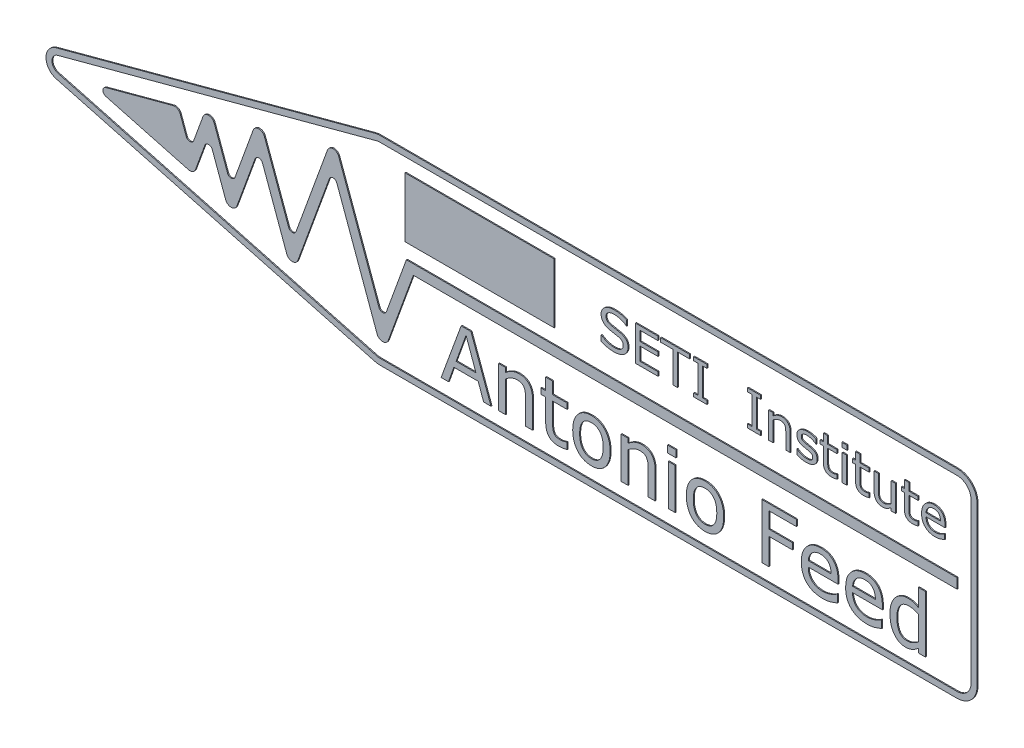
from build123d import *

# Parameters (mm, degrees)
BOSS_EXTRUDE2_DEPTH           = 0.254
BOSS_EXTRUDE1_DEPTH           = 0.254
BE_00_TEXT_SETI_INST_DEPTH    = 0.254
BE_00_TEXT_SETI_INST_2_DEPTH  = 0.254
BE_00_TEXT_SETI_INST_3_DEPTH  = 0.254
BE_00_TEXT_SETI_INST_4_DEPTH  = 0.254
SKETCH4_W                     = 1.350379747
SKETCH4_H                     = 1.125316456
BE_00_TEXT_SETI_INST_5_DEPTH  = 0.254
SKETCH4_W_2                   = 1.125316456
SKETCH4_H_2                   = 6.639367089
BE_00_TEXT_SETI_INST_6_DEPTH  = 0.254
BE_00_TEXT_SETI_INST_7_DEPTH  = 0.254
BE_00_TEXT_SETI_INST_8_DEPTH  = 0.254
BE_00_TEXT_SETI_INST_9_DEPTH  = 0.254
BE_00_TEXT_SETI_INST_10_DEPTH = 0.254
BE_00_TEXT_SETI_INST_11_DEPTH = 0.254
BE_00_TEXT_SETI_INST_12_DEPTH = 0.254
BE_00_TEXT_SETI_INST_13_DEPTH = 0.254
BE_00_TEXT_SETI_INST_14_DEPTH = 0.254
BE_00_TEXT_FRANKLIN_DEPTH     = 0.254
BE_00_TEXT_FRANKLIN_2_DEPTH   = 0.254
BE_00_TEXT_FRANKLIN_3_DEPTH   = 0.254
BE_00_TEXT_FRANKLIN_4_DEPTH   = 0.254
BE_00_TEXT_FRANKLIN_5_DEPTH   = 0.254
SKETCH6_W                     = 2.122025317
SKETCH6_H                     = 1.76835443
BE_00_TEXT_FRANKLIN_6_DEPTH   = 0.254
SKETCH6_W_2                   = 1.76835443
SKETCH6_H_2                   = 10.433291139
BE_00_TEXT_FRANKLIN_7_DEPTH   = 0.254
BE_00_TEXT_FRANKLIN_8_DEPTH   = 0.254
BE_00_TEXT_FRANKLIN_9_DEPTH   = 0.254
BE_00_TEXT_FRANKLIN_10_DEPTH  = 0.254
BE_00_TEXT_FRANKLIN_11_DEPTH  = 0.254
BE_00_TEXT_FRANKLIN_12_DEPTH  = 0.254
SKETCH5_W                     = 38.1
SKETCH5_H                     = 15.24
BOSS_EXTRUDE4_DEPTH           = 0.254


with BuildPart() as part:
    # Sketch3 → Boss-Extrude2 (new body)
    with BuildSketch(Plane.XY):
        with BuildLine():
            Line((0, -20.32), (0, 20.32))
            ThreePointArc((0, 20.32), (-1.487897552, 23.912102448), (-5.08, 25.4))
            Line((-5.08, 25.4), (-152.4, 25.4))
            ThreePointArc((-152.4, 25.4), (-153.063073056, 25.356539896), (-153.714800749, 25.226903198))
            Line((-153.714800749, 25.226903198), (-235.043916771, 3.434832238))
            ThreePointArc((-235.043916771, 3.434832238), (-237.679556247, 0), (-235.043916771, -3.434832238))
            Line((-235.043916771, -3.434832238), (-153.714800749, -25.226903198))
            ThreePointArc((-153.714800749, -25.226903198), (-153.063073056, -25.356539896), (-152.4, -25.4))
            Line((-152.4, -25.4), (-5.08, -25.4))
            ThreePointArc((-5.08, -25.4), (-1.487897552, -23.912102448), (0, -20.32))
        make_face()
        with BuildLine():
            Line((-5.08, 23.876), (-152.4, 23.876))
            ThreePointArc((-152.4, 23.876), (-152.86415114, 23.845577927), (-153.320360524, 23.754832238))
            Line((-153.320360524, 23.754832238), (-234.649476547, 1.962761279))
            ThreePointArc((-234.649476547, 1.962761279), (-236.155556247, 0), (-234.649476547, -1.962761279))
            Line((-234.649476547, -1.962761279), (-153.320360524, -23.754832238))
            ThreePointArc((-153.320360524, -23.754832238), (-152.86415114, -23.845577927), (-152.4, -23.876))
            Line((-152.4, -23.876), (-5.08, -23.876))
            ThreePointArc((-5.08, -23.876), (-2.565528286, -22.834471714), (-1.524, -20.32))
            Line((-1.524, -20.32), (-1.524, 20.32))
            ThreePointArc((-1.524, 20.32), (-2.565528286, 22.834471714), (-5.08, 23.876))
        make_face(mode=Mode.SUBTRACT)
    extrude(amount=BOSS_EXTRUDE2_DEPTH)


with BuildPart() as body_2:
    # Sketch1 → Boss-Extrude1 (new body)
    with BuildSketch(Plane.XY):
        with BuildLine():
            Line((-5.08, 1.27), (-145.669263574, 1.27))
            Line((-145.669263574, 1.27), (-150.770822123, -12.746416919))
            ThreePointArc((-150.770822123, -12.746416919), (-151.725549826, -13.414924454), (-152.680277529, -12.746416919))
            Line((-152.680277529, -12.746416919), (-162.950202255, 15.469969364))
            ThreePointArc((-162.950202255, 15.469969364), (-164.382293809, 16.472730666), (-165.814385363, 15.469969364))
            Line((-165.814385363, 15.469969364), (-173.834967116, -6.566397894))
            ThreePointArc((-173.834967116, -6.566397894), (-174.789694819, -7.234905429), (-175.744422522, -6.566397894))
            Line((-175.744422522, -6.566397894), (-181.915412125, 10.388256695))
            ThreePointArc((-181.915412125, 10.388256695), (-183.347503679, 11.391017997), (-184.779595233, 10.388256695))
            Line((-184.779595233, 10.388256695), (-189.42970022, -2.387801753))
            ThreePointArc((-189.42970022, -2.387801753), (-190.384427922, -3.056309288), (-191.339155625, -2.387801753))
            Line((-191.339155625, -2.387801753), (-194.738665979, 6.952276181))
            ThreePointArc((-194.738665979, 6.952276181), (-196.170757533, 7.955037483), (-197.602849087, 6.952276181))
            Line((-197.602849087, 6.952276181), (-199.974019145, 0.437539988))
            ThreePointArc((-199.974019145, 0.437539988), (-200.928746848, -0.230967547), (-201.883474551, 0.437539988))
            Line((-201.883474551, 0.437539988), (-203.409059849, 4.629051145))
            ThreePointArc((-203.409059849, 4.629051145), (-204.137446516, 5.459616957), (-205.235591628, 5.579883406))
            Line((-205.235591628, 5.579883406), (-222.397437592, 0.98138064))
            ThreePointArc((-222.397437592, 0.98138064), (-223.150477442, 0), (-222.397437592, -0.98138064))
            Line((-222.397437592, -0.98138064), (-201.323187073, -6.628209047))
            ThreePointArc((-201.323187073, -6.628209047), (-200.225041962, -6.507942598), (-199.496655294, -5.677376786))
            Line((-199.496655294, -5.677376786), (-197.125485236, 0.837359407))
            ThreePointArc((-197.125485236, 0.837359407), (-196.170757533, 1.505866941), (-195.21602983, 0.837359407))
            Line((-195.21602983, 0.837359407), (-191.816519476, -8.502718527))
            ThreePointArc((-191.816519476, -8.502718527), (-190.384427922, -9.505479829), (-188.952336368, -8.502718527))
            Line((-188.952336368, -8.502718527), (-184.302231382, 4.273339922))
            ThreePointArc((-184.302231382, 4.273339922), (-183.347503679, 4.941847456), (-182.392775976, 4.273339922))
            Line((-182.392775976, 4.273339922), (-176.221786373, -12.681314668))
            ThreePointArc((-176.221786373, -12.681314668), (-174.789694819, -13.68407597), (-173.357603265, -12.681314668))
            Line((-173.357603265, -12.681314668), (-165.337021511, 9.355052591))
            ThreePointArc((-165.337021511, 9.355052591), (-164.382293809, 10.023560125), (-163.427566106, 9.355052591))
            Line((-163.427566106, 9.355052591), (-153.15764138, -18.861333693))
            ThreePointArc((-153.15764138, -18.861333693), (-151.725549826, -19.864094995), (-150.293458272, -18.861333693))
            Line((-150.293458272, -18.861333693), (-143.890736426, -1.27))
            Line((-143.890736426, -1.27), (-5.08, -1.27))
            Line((-5.08, -1.27), (-5.08, 1.27))
        make_face()
    extrude(amount=BOSS_EXTRUDE1_DEPTH)


with BuildPart() as body_3:
    # Sketch4 → BE-00 Text SETI Inst (new body)
    with BuildSketch(Plane.XY):
        with BuildLine():
            Line((-8.182658228, 10.770886076), (-13.021518987, 10.770886076))
            add(Edge.make_bspline(
                [(-13.021518987, 10.770886076), (-13.018939607, 10.677610397), (-13.013925856, 10.496302909), (-12.981426164, 10.233249369), (-12.922921148, 9.989545339), (-12.843905784, 9.764116283), (-12.743627014, 9.558827716), (-12.626328444, 9.372060892), (-12.493378254, 9.202761091), (-12.389277469, 9.106258534), (-12.337537579, 9.058295095)],
                knots=[0, 0, 0, 0, 1.176706644, 2.287259947, 3.336330889, 4.332508499, 5.294744663, 6.21168884, 7.111178427, 8, 8, 8, 8], degree=3))
            add(Edge.make_bspline(
                [(-12.337537579, 9.058295095), (-12.284515945, 9.014870154), (-12.178478505, 8.928025044), (-12.00148509, 8.818739058), (-11.811451088, 8.7252885), (-11.606832112, 8.649897163), (-11.389958629, 8.592665569), (-11.162611969, 8.550082584), (-10.924396529, 8.525571808), (-10.762149702, 8.522048804), (-10.679454114, 8.520253165)],
                knots=[0, 0, 0, 0, 0.922576331, 1.845051259, 2.795102616, 3.772079905, 4.777775272, 5.813982318, 6.885808602, 8, 8, 8, 8], degree=3))
            add(Edge.make_bspline(
                [(-10.679454114, 8.520253165), (-10.566711824, 8.522988922), (-10.34007353, 8.528488432), (-10.000788146, 8.583422939), (-9.66020251, 8.664735598), (-9.329301478, 8.78091919), (-9.02121383, 8.908302528), (-8.753560858, 9.039962457), (-8.531859468, 9.166848984), (-8.410295558, 9.263836193), (-8.35497231, 9.307974684)],
                knots=[0, 0, 0, 0, 1.084020539, 2.179134077, 3.299415693, 4.449772161, 5.549522961, 6.505439399, 7.319831464, 8, 8, 8, 8], degree=3))
            Line((-8.35497231, 9.307974684), (-8.295189873, 9.307974684))
            Line((-8.295189873, 9.307974684), (-8.295189873, 8.073643196))
            add(Edge.make_bspline(
                [(-8.295189873, 8.073643196), (-8.48299553, 7.997384648), (-8.858211368, 7.845028135), (-9.340986505, 7.690652854), (-9.735501296, 7.595179277), (-10.039152155, 7.544048301), (-10.350621857, 7.513903061), (-10.560996122, 7.509626304), (-10.667145965, 7.507468354)],
                knots=[0, 0, 0, 0, 1.485223209, 2.96731889, 3.709110163, 4.45833828, 5.222114217, 6, 6, 6, 6], degree=3))
            add(Edge.make_bspline(
                [(-10.667145965, 7.507468354), (-10.800329467, 7.509905665), (-11.059195282, 7.51464301), (-11.436393154, 7.558996836), (-11.792075816, 7.624592173), (-12.124484545, 7.725201042), (-12.436139653, 7.847842207), (-12.722546444, 8.005816145), (-12.989816834, 8.185618586), (-13.231437899, 8.396761875), (-13.448285866, 8.63189063), (-13.636052973, 8.893100092), (-13.794939479, 9.177344592), (-13.92310006, 9.485690886), (-14.023684579, 9.816719714), (-14.094493128, 10.171219608), (-14.139901454, 10.549334313), (-14.144480467, 10.809432306), (-14.146835443, 10.943200158)],
                knots=[0, 0, 0, 0, 1.14925625, 2.233783856, 3.274710121, 4.267229545, 5.227459503, 6.160250376, 7.085075717, 8.003233561, 8.923549731, 9.840521819, 10.77376542, 11.728487526, 12.71762228, 13.755556115, 14.845687214, 16, 16, 16, 16], degree=3))
            add(Edge.make_bspline(
                [(-14.146835443, 10.943200158), (-14.14414022, 11.075765482), (-14.138891642, 11.333918316), (-14.097915078, 11.710898745), (-14.030203888, 12.067014478), (-13.93351384, 12.401931504), (-13.809917062, 12.716069806), (-13.658556681, 13.009335726), (-13.478164732, 13.281260064), (-13.272284124, 13.530828309), (-13.045191181, 13.756040971), (-12.796619771, 13.949633377), (-12.533800037, 14.118036395), (-12.250192323, 14.250086799), (-11.951255584, 14.358208052), (-11.633315708, 14.429401528), (-11.299286946, 14.477918371), (-11.070567558, 14.48222883), (-10.95375, 14.48443038)],
                knots=[0, 0, 0, 0, 1.183285302, 2.304286274, 3.380770305, 4.415760614, 5.411710031, 6.389949371, 7.356475545, 8.319212603, 9.273824549, 10.205444412, 11.127270461, 12.054117136, 12.99248663, 13.959635803, 14.957891742, 16, 16, 16, 16], degree=3))
            add(Edge.make_bspline(
                [(-10.95375, 14.48443038), (-10.845764209, 14.482458013), (-10.636086367, 14.478628235), (-10.331577405, 14.437757333), (-10.044905053, 14.377830965), (-9.776744861, 14.290329854), (-9.528674198, 14.175079277), (-9.299980959, 14.034976414), (-9.089486253, 13.870880567), (-8.899186733, 13.681781499), (-8.729076643, 13.46989235), (-8.584004823, 13.234389827), (-8.457609263, 12.979492591), (-8.356160832, 12.702946289), (-8.279218465, 12.404674701), (-8.224188614, 12.086533879), (-8.187196518, 11.747025569), (-8.184201208, 11.51358134), (-8.182658228, 11.393326741)],
                knots=[0, 0, 0, 0, 1.09687215, 2.129815267, 3.117107136, 4.070293991, 4.989770398, 5.890866531, 6.790543863, 7.696176979, 8.611611542, 9.545505155, 10.501906815, 11.498926989, 12.533449163, 13.628378512, 14.778301805, 16, 16, 16, 16], degree=3))
            Line((-8.182658228, 11.393326741), (-8.182658228, 10.770886076))
        make_face()
        with BuildLine():
            add(Edge.make_bspline(
                [(-9.307974684, 11.671139241), (-9.309267465, 11.74503802), (-9.311786782, 11.889048729), (-9.332944502, 12.098346447), (-9.368245174, 12.294556046), (-9.415633898, 12.478022164), (-9.474572873, 12.649337171), (-9.549008266, 12.8072532), (-9.637390656, 12.951873655), (-9.737667908, 13.084223456), (-9.850527955, 13.204129827), (-9.979923115, 13.305610847), (-10.121857745, 13.39295936), (-10.277953404, 13.46326136), (-10.447853978, 13.517906021), (-10.631874346, 13.555356381), (-10.829337132, 13.581497866), (-10.965965924, 13.583265895), (-11.036390427, 13.584177215)],
                knots=[0, 0, 0, 0, 1.205026845, 2.348303604, 3.426426005, 4.453506336, 5.436028135, 6.376741375, 7.294792973, 8.195258634, 9.080940176, 9.972175278, 10.868929551, 11.792933566, 12.757245033, 13.773368931, 14.852296171, 16, 16, 16, 16], degree=3))
            add(Edge.make_bspline(
                [(-11.036390427, 13.584177215), (-11.107992281, 13.582640939), (-11.247602313, 13.579645492), (-11.451030751, 13.551889389), (-11.643367087, 13.510934051), (-11.824312922, 13.450556099), (-11.994117143, 13.372821001), (-12.153231127, 13.277887989), (-12.299674051, 13.163988096), (-12.434696536, 13.035770043), (-12.557148037, 12.895268615), (-12.667123875, 12.745902529), (-12.760080959, 12.585934246), (-12.84122453, 12.419240021), (-12.908500926, 12.243986791), (-12.961038585, 12.060405151), (-13.000223028, 11.86872926), (-13.014364497, 11.73752065), (-13.021518987, 11.671139241)],
                knots=[0, 0, 0, 0, 1.123083604, 2.189800004, 3.216384171, 4.205316892, 5.176641095, 6.14202442, 7.106048452, 8.081977966, 9.059726225, 10.027429082, 10.988112514, 11.958957555, 12.934323436, 13.929906526, 14.952692797, 16, 16, 16, 16], degree=3))
            Line((-13.021518987, 11.671139241), (-9.307974684, 11.671139241))
        make_face(mode=Mode.SUBTRACT)
    extrude(amount=BE_00_TEXT_SETI_INST_DEPTH)


with BuildPart() as body_4:
    # Sketch4 → BE-00 Text SETI Inst 2 (new body)
    with BuildSketch(Plane.XY):
        with BuildLine():
            add(Edge.make_bspline(
                [(-15.047088608, 7.704398734), (-15.158736648, 7.676621594), (-15.389928656, 7.619102872), (-15.743111, 7.559777567), (-16.089959508, 7.517360279), (-16.315893696, 7.510631117), (-16.422084652, 7.507468354)],
                knots=[0, 0, 0, 0, 0.991293069, 2.052691954, 3.084748954, 4, 4, 4, 4], degree=3))
            add(Edge.make_bspline(
                [(-16.422084652, 7.507468354), (-16.505979986, 7.508999419), (-16.668933232, 7.511973267), (-16.905150727, 7.539402), (-17.12611117, 7.580353313), (-17.331637714, 7.640566998), (-17.522435134, 7.717433948), (-17.697232002, 7.813071596), (-17.857240313, 7.924214002), (-18.001097093, 8.053860841), (-18.129151994, 8.20268444), (-18.238086106, 8.372980782), (-18.329818082, 8.563326773), (-18.40500996, 8.773861349), (-18.464773665, 9.005054086), (-18.506176195, 9.257491182), (-18.530445386, 9.530215325), (-18.533824969, 9.718781417), (-18.53556962, 9.816125396)],
                knots=[0, 0, 0, 0, 1.118506439, 2.172519573, 3.167485138, 4.112398457, 5.024003236, 5.905517766, 6.764279695, 7.616649519, 8.481473748, 9.374797184, 10.304751025, 11.293834179, 12.351782154, 13.485239396, 14.70179839, 16, 16, 16, 16], degree=3))
            Line((-18.53556962, 9.816125396), (-18.53556962, 13.359113924))
            Line((-18.53556962, 13.359113924), (-19.323291139, 13.359113924))
            Line((-19.323291139, 13.359113924), (-19.323291139, 14.259367089))
            Line((-19.323291139, 14.259367089), (-18.53556962, 14.259367089))
            Line((-18.53556962, 14.259367089), (-18.53556962, 16.172405063))
            Line((-18.53556962, 16.172405063), (-17.410253165, 16.172405063))
            Line((-17.410253165, 16.172405063), (-17.410253165, 14.259367089))
            Line((-17.410253165, 14.259367089), (-15.047088608, 14.259367089))
            Line((-15.047088608, 14.259367089), (-15.047088608, 13.359113924))
            Line((-15.047088608, 13.359113924), (-17.410253165, 13.359113924))
            Line((-17.410253165, 13.359113924), (-17.410253165, 10.34010087))
            add(Edge.make_bspline(
                [(-17.410253165, 10.34010087), (-17.410006181, 10.258041689), (-17.409540383, 10.103282105), (-17.403799734, 9.885836487), (-17.397256991, 9.696449274), (-17.387780022, 9.531431093), (-17.369530807, 9.381962289), (-17.333375635, 9.24173515), (-17.282862875, 9.10597064), (-17.237716469, 9.020344145), (-17.215081092, 8.977412975)],
                knots=[0, 0, 0, 0, 1.413193584, 2.665213661, 3.746024204, 4.676643398, 5.511764138, 6.334346291, 7.164879261, 8, 8, 8, 8], degree=3))
            add(Edge.make_bspline(
                [(-17.215081092, 8.977412975), (-17.191484153, 8.939771117), (-17.145370763, 8.866210997), (-17.059519758, 8.769146013), (-16.959793161, 8.689776227), (-16.845138289, 8.623240746), (-16.706691172, 8.576127444), (-16.541674553, 8.544629743), (-16.34701817, 8.52333107), (-16.207051393, 8.521327833), (-16.131964003, 8.520253165)],
                knots=[0, 0, 0, 0, 0.857181419, 1.675113097, 2.48840923, 3.30985891, 4.222931757, 5.297525167, 6.550214669, 8, 8, 8, 8], degree=3))
            add(Edge.make_bspline(
                [(-16.131964003, 8.520253165), (-16.036093071, 8.524471563), (-15.838292538, 8.533174947), (-15.597018974, 8.588846425), (-15.412008416, 8.643124283), (-15.291546146, 8.679149796), (-15.192280522, 8.712205891), (-15.134339151, 8.735140077), (-15.108629351, 8.745316456)],
                knots=[0, 0, 0, 0, 1.637462528, 3.378406307, 4.212366495, 4.934961928, 5.527420318, 6, 6, 6, 6], degree=3))
            Line((-15.108629351, 8.745316456), (-15.047088608, 8.745316456))
            Line((-15.047088608, 8.745316456), (-15.047088608, 7.704398734))
        make_face()
    extrude(amount=BE_00_TEXT_SETI_INST_2_DEPTH)


with BuildPart() as body_5:
    # Sketch4 → BE-00 Text SETI Inst 3 (new body)
    with BuildSketch(Plane.XY):
        with BuildLine():
            Line((-20.786202532, 7.62), (-21.911518987, 7.62))
            Line((-21.911518987, 7.62), (-21.911518987, 8.321564478))
            add(Edge.make_bspline(
                [(-21.911518987, 8.321564478), (-22.002727412, 8.250137256), (-22.179966081, 8.111337955), (-22.451961448, 7.926911991), (-22.716368994, 7.766179751), (-22.977813765, 7.630997219), (-23.244029601, 7.524846248), (-23.520951345, 7.448830407), (-23.81199796, 7.404533548), (-24.010201054, 7.398175399), (-24.111160997, 7.394936709)],
                knots=[0, 0, 0, 0, 1.140189534, 2.215647027, 3.232894384, 4.185093575, 5.109763033, 6.049007488, 7.00621081, 8, 8, 8, 8], degree=3))
            add(Edge.make_bspline(
                [(-24.111160997, 7.394936709), (-24.195068284, 7.396975691), (-24.358744145, 7.400953082), (-24.597077761, 7.431508086), (-24.821731076, 7.480006421), (-25.032192494, 7.549788806), (-25.22657637, 7.643329387), (-25.409466637, 7.751171946), (-25.575950337, 7.883249083), (-25.727364463, 8.03500516), (-25.863355679, 8.205540795), (-25.979563588, 8.396466866), (-26.080773909, 8.604325421), (-26.160656402, 8.832999493), (-26.224351299, 9.079360798), (-26.266470304, 9.34495687), (-26.296229075, 9.627899691), (-26.2988871, 9.823074214), (-26.300253165, 9.92338212)],
                knots=[0, 0, 0, 0, 1.057748356, 2.063323441, 3.024436989, 3.95224103, 4.851436091, 5.739907335, 6.624034101, 7.522864649, 8.438133624, 9.367231838, 10.335704709, 11.347857469, 12.416164176, 13.540006142, 14.735711875, 16, 16, 16, 16], degree=3))
            Line((-26.300253165, 9.92338212), (-26.300253165, 14.259367089))
            Line((-26.300253165, 14.259367089), (-25.174936709, 14.259367089))
            Line((-25.174936709, 14.259367089), (-25.174936709, 10.419224684))
            add(Edge.make_bspline(
                [(-25.174936709, 10.419224684), (-25.174180359, 10.336576381), (-25.17272622, 10.177678847), (-25.16397002, 9.948419347), (-25.149946547, 9.73791982), (-25.13194995, 9.544563447), (-25.102894875, 9.366528997), (-25.05853014, 9.203147282), (-25.003441688, 9.051291919), (-24.953367009, 8.95929604), (-24.928773734, 8.914113924)],
                knots=[0, 0, 0, 0, 1.286113747, 2.472649752, 3.569533974, 4.568713195, 5.493844051, 6.372158704, 7.200515109, 8, 8, 8, 8], degree=3))
            add(Edge.make_bspline(
                [(-24.928773734, 8.914113924), (-24.901827236, 8.872211563), (-24.849039792, 8.790125997), (-24.750763465, 8.68362126), (-24.64089201, 8.595271714), (-24.51762978, 8.521441809), (-24.372677435, 8.468958701), (-24.202892347, 8.433357163), (-24.005688277, 8.410573933), (-23.86448251, 8.408711788), (-23.789390823, 8.407721519)],
                knots=[0, 0, 0, 0, 0.90733224, 1.777438778, 2.628892557, 3.47225505, 4.385612806, 5.425683215, 6.63100641, 8, 8, 8, 8], degree=3))
            add(Edge.make_bspline(
                [(-23.789390823, 8.407721519), (-23.716490984, 8.410415985), (-23.565924969, 8.415981086), (-23.336623853, 8.464240644), (-23.096368662, 8.533480039), (-22.851163686, 8.635197931), (-22.604994253, 8.756129875), (-22.364935018, 8.896583235), (-22.131988938, 9.050297436), (-21.985187508, 9.165676124), (-21.911518987, 9.223575949)],
                knots=[0, 0, 0, 0, 0.839202479, 1.733273716, 2.690683632, 3.717826669, 4.787049691, 5.84927495, 6.920713981, 8, 8, 8, 8], degree=3))
            Line((-21.911518987, 9.223575949), (-21.911518987, 14.259367089))
            Line((-21.911518987, 14.259367089), (-20.786202532, 14.259367089))
            Line((-20.786202532, 14.259367089), (-20.786202532, 7.62))
        make_face()
    extrude(amount=BE_00_TEXT_SETI_INST_3_DEPTH)


with BuildPart() as body_6:
    # Sketch4 → BE-00 Text SETI Inst 4 (new body)
    with BuildSketch(Plane.XY):
        with BuildLine():
            add(Edge.make_bspline(
                [(-27.538101266, 7.704398734), (-27.649749306, 7.676621594), (-27.880941314, 7.619102872), (-28.234123658, 7.559777567), (-28.580972167, 7.517360279), (-28.806906355, 7.510631117), (-28.91309731, 7.507468354)],
                knots=[0, 0, 0, 0, 0.991293069, 2.052691954, 3.084748954, 4, 4, 4, 4], degree=3))
            add(Edge.make_bspline(
                [(-28.91309731, 7.507468354), (-28.996992644, 7.508999419), (-29.159945891, 7.511973267), (-29.396163385, 7.539402), (-29.617123828, 7.580353313), (-29.822650372, 7.640566998), (-30.013447792, 7.717433948), (-30.18824466, 7.813071596), (-30.348252971, 7.924214002), (-30.492109752, 8.053860841), (-30.620164653, 8.20268444), (-30.729098764, 8.372980782), (-30.82083074, 8.563326773), (-30.896022618, 8.773861349), (-30.955786323, 9.005054086), (-30.997188853, 9.257491182), (-31.021458044, 9.530215325), (-31.024837627, 9.718781417), (-31.026582278, 9.816125396)],
                knots=[0, 0, 0, 0, 1.118506439, 2.172519573, 3.167485138, 4.112398457, 5.024003236, 5.905517766, 6.764279695, 7.616649519, 8.481473748, 9.374797184, 10.304751025, 11.293834179, 12.351782154, 13.485239396, 14.70179839, 16, 16, 16, 16], degree=3))
            Line((-31.026582278, 9.816125396), (-31.026582278, 13.359113924))
            Line((-31.026582278, 13.359113924), (-31.814303797, 13.359113924))
            Line((-31.814303797, 13.359113924), (-31.814303797, 14.259367089))
            Line((-31.814303797, 14.259367089), (-31.026582278, 14.259367089))
            Line((-31.026582278, 14.259367089), (-31.026582278, 16.172405063))
            Line((-31.026582278, 16.172405063), (-29.901265823, 16.172405063))
            Line((-29.901265823, 16.172405063), (-29.901265823, 14.259367089))
            Line((-29.901265823, 14.259367089), (-27.538101266, 14.259367089))
            Line((-27.538101266, 14.259367089), (-27.538101266, 13.359113924))
            Line((-27.538101266, 13.359113924), (-29.901265823, 13.359113924))
            Line((-29.901265823, 13.359113924), (-29.901265823, 10.34010087))
            add(Edge.make_bspline(
                [(-29.901265823, 10.34010087), (-29.90101884, 10.258041689), (-29.900553041, 10.103282105), (-29.894812392, 9.885836487), (-29.888269649, 9.696449274), (-29.87879268, 9.531431093), (-29.860543465, 9.381962289), (-29.824388293, 9.24173515), (-29.773875534, 9.10597064), (-29.728729127, 9.020344145), (-29.70609375, 8.977412975)],
                knots=[0, 0, 0, 0, 1.413193584, 2.665213661, 3.746024204, 4.676643398, 5.511764138, 6.334346291, 7.164879261, 8, 8, 8, 8], degree=3))
            add(Edge.make_bspline(
                [(-29.70609375, 8.977412975), (-29.682496811, 8.939771117), (-29.636383422, 8.866210997), (-29.550532416, 8.769146013), (-29.450805819, 8.689776227), (-29.336150947, 8.623240746), (-29.197703831, 8.576127444), (-29.032687211, 8.544629743), (-28.838030828, 8.52333107), (-28.698064051, 8.521327833), (-28.622976661, 8.520253165)],
                knots=[0, 0, 0, 0, 0.857181419, 1.675113097, 2.48840923, 3.30985891, 4.222931757, 5.297525167, 6.550214669, 8, 8, 8, 8], degree=3))
            add(Edge.make_bspline(
                [(-28.622976661, 8.520253165), (-28.527105729, 8.524471563), (-28.329305196, 8.533174947), (-28.088031632, 8.588846425), (-27.903021075, 8.643124283), (-27.782558804, 8.679149796), (-27.683293181, 8.712205891), (-27.625351809, 8.735140077), (-27.599642009, 8.745316456)],
                knots=[0, 0, 0, 0, 1.637462528, 3.378406307, 4.212366495, 4.934961928, 5.527420318, 6, 6, 6, 6], degree=3))
            Line((-27.599642009, 8.745316456), (-27.538101266, 8.745316456))
            Line((-27.538101266, 8.745316456), (-27.538101266, 7.704398734))
        make_face()
    extrude(amount=BE_00_TEXT_SETI_INST_4_DEPTH)


with BuildPart() as body_7:
    # Sketch4 → BE-00 Text SETI Inst 5 (new body)
    with BuildSketch(Plane.XY):
        with Locations((-33.839873418, 15.947341772)):
            Rectangle(SKETCH4_W, SKETCH4_H)
    extrude(amount=BE_00_TEXT_SETI_INST_5_DEPTH)


with BuildPart() as body_8:
    # Sketch4 → BE-00 Text SETI Inst 6 (new body)
    with BuildSketch(Plane.XY):
        with Locations((-33.839873418, 10.939683545)):
            Rectangle(SKETCH4_W_2, SKETCH4_H_2)
    extrude(amount=BE_00_TEXT_SETI_INST_6_DEPTH)


with BuildPart() as body_9:
    # Sketch4 → BE-00 Text SETI Inst 7 (new body)
    with BuildSketch(Plane.XY):
        with BuildLine():
            add(Edge.make_bspline(
                [(-35.752911392, 7.704398734), (-35.864559433, 7.676621594), (-36.095751441, 7.619102872), (-36.448933785, 7.559777567), (-36.795782293, 7.517360279), (-37.021716481, 7.510631117), (-37.127907437, 7.507468354)],
                knots=[0, 0, 0, 0, 0.991293069, 2.052691954, 3.084748954, 4, 4, 4, 4], degree=3))
            add(Edge.make_bspline(
                [(-37.127907437, 7.507468354), (-37.211802771, 7.508999419), (-37.374756017, 7.511973267), (-37.610973512, 7.539402), (-37.831933955, 7.580353313), (-38.037460499, 7.640566998), (-38.228257919, 7.717433948), (-38.403054787, 7.813071596), (-38.563063097, 7.924214002), (-38.706919878, 8.053860841), (-38.834974779, 8.20268444), (-38.943908891, 8.372980782), (-39.035640867, 8.563326773), (-39.110832745, 8.773861349), (-39.17059645, 9.005054086), (-39.211998979, 9.257491182), (-39.236268171, 9.530215325), (-39.239647754, 9.718781417), (-39.241392405, 9.816125396)],
                knots=[0, 0, 0, 0, 1.118506439, 2.172519573, 3.167485138, 4.112398457, 5.024003236, 5.905517766, 6.764279695, 7.616649519, 8.481473748, 9.374797184, 10.304751025, 11.293834179, 12.351782154, 13.485239396, 14.70179839, 16, 16, 16, 16], degree=3))
            Line((-39.241392405, 9.816125396), (-39.241392405, 13.359113924))
            Line((-39.241392405, 13.359113924), (-40.029113924, 13.359113924))
            Line((-40.029113924, 13.359113924), (-40.029113924, 14.259367089))
            Line((-40.029113924, 14.259367089), (-39.241392405, 14.259367089))
            Line((-39.241392405, 14.259367089), (-39.241392405, 16.172405063))
            Line((-39.241392405, 16.172405063), (-38.116075949, 16.172405063))
            Line((-38.116075949, 16.172405063), (-38.116075949, 14.259367089))
            Line((-38.116075949, 14.259367089), (-35.752911392, 14.259367089))
            Line((-35.752911392, 14.259367089), (-35.752911392, 13.359113924))
            Line((-35.752911392, 13.359113924), (-38.116075949, 13.359113924))
            Line((-38.116075949, 13.359113924), (-38.116075949, 10.34010087))
            add(Edge.make_bspline(
                [(-38.116075949, 10.34010087), (-38.115828966, 10.258041689), (-38.115363168, 10.103282105), (-38.109622518, 9.885836487), (-38.103079775, 9.696449274), (-38.093602807, 9.531431093), (-38.075353592, 9.381962289), (-38.039198419, 9.24173515), (-37.98868566, 9.10597064), (-37.943539254, 9.020344145), (-37.920903877, 8.977412975)],
                knots=[0, 0, 0, 0, 1.413193584, 2.665213661, 3.746024204, 4.676643398, 5.511764138, 6.334346291, 7.164879261, 8, 8, 8, 8], degree=3))
            add(Edge.make_bspline(
                [(-37.920903877, 8.977412975), (-37.897306938, 8.939771117), (-37.851193548, 8.866210997), (-37.765342542, 8.769146013), (-37.665615946, 8.689776227), (-37.550961074, 8.623240746), (-37.412513957, 8.576127444), (-37.247497338, 8.544629743), (-37.052840954, 8.52333107), (-36.912874177, 8.521327833), (-36.837786788, 8.520253165)],
                knots=[0, 0, 0, 0, 0.857181419, 1.675113097, 2.48840923, 3.30985891, 4.222931757, 5.297525167, 6.550214669, 8, 8, 8, 8], degree=3))
            add(Edge.make_bspline(
                [(-36.837786788, 8.520253165), (-36.741915856, 8.524471563), (-36.544115322, 8.533174947), (-36.302841759, 8.588846425), (-36.117831201, 8.643124283), (-35.99736893, 8.679149796), (-35.898103307, 8.712205891), (-35.840161935, 8.735140077), (-35.814452136, 8.745316456)],
                knots=[0, 0, 0, 0, 1.637462528, 3.378406307, 4.212366495, 4.934961928, 5.527420318, 6, 6, 6, 6], degree=3))
            Line((-35.814452136, 8.745316456), (-35.752911392, 8.745316456))
            Line((-35.752911392, 8.745316456), (-35.752911392, 7.704398734))
        make_face()
    extrude(amount=BE_00_TEXT_SETI_INST_7_DEPTH)


with BuildPart() as body_10:
    # Sketch4 → BE-00 Text SETI Inst 8 (new body)
    with BuildSketch(Plane.XY):
        with BuildLine():
            add(Edge.make_bspline(
                [(-40.816835443, 9.587545491), (-40.819217371, 9.512960634), (-40.823896002, 9.366459599), (-40.860270345, 9.152367157), (-40.917579177, 8.948177882), (-41.001964099, 8.755195448), (-41.107097491, 8.571604993), (-41.237752431, 8.399242667), (-41.391338564, 8.237436315), (-41.567182738, 8.087088936), (-41.761970563, 7.948833391), (-41.977735365, 7.832099362), (-42.208976336, 7.731683938), (-42.456916629, 7.648074059), (-42.722684556, 7.586155241), (-43.005261309, 7.540698663), (-43.304821885, 7.511695299), (-43.510493101, 7.508902066), (-43.616060127, 7.507468354)],
                knots=[0, 0, 0, 0, 0.916001159, 1.799227398, 2.66084411, 3.515692511, 4.380373667, 5.254658377, 6.166545334, 7.116402507, 8.093418153, 9.095797354, 10.124654574, 11.188188832, 12.306120081, 13.47350273, 14.703198215, 16, 16, 16, 16], degree=3))
            add(Edge.make_bspline(
                [(-43.616060127, 7.507468354), (-43.736296883, 7.509241003), (-43.971981145, 7.512715694), (-44.317339074, 7.547409581), (-44.647604442, 7.601254906), (-44.960282814, 7.6767327), (-45.252182262, 7.767875795), (-45.522349176, 7.859900401), (-45.768520344, 7.955442252), (-45.920427114, 8.02819606), (-45.993291139, 8.063093354)],
                knots=[0, 0, 0, 0, 1.171581892, 2.296497538, 3.379330487, 4.430974221, 5.428471147, 6.358851541, 7.212802147, 8, 8, 8, 8], degree=3))
            Line((-45.993291139, 8.063093354), (-45.993291139, 9.307974684))
            Line((-45.993291139, 9.307974684), (-45.933508703, 9.307974684))
            add(Edge.make_bspline(
                [(-45.933508703, 9.307974684), (-45.843578148, 9.241597798), (-45.663441577, 9.10864071), (-45.376249668, 8.932747017), (-45.07336807, 8.779834115), (-44.760514996, 8.646281938), (-44.441376654, 8.542025011), (-44.125750011, 8.465828084), (-43.816811812, 8.417637143), (-43.612706503, 8.410990555), (-43.512320016, 8.407721519)],
                knots=[0, 0, 0, 0, 1.020892534, 2.044912109, 3.072300431, 4.118578031, 5.149852529, 6.135649549, 7.083043969, 8, 8, 8, 8], degree=3))
            add(Edge.make_bspline(
                [(-43.512320016, 8.407721519), (-43.396087003, 8.410385923), (-43.175434878, 8.415443923), (-42.864823354, 8.46272165), (-42.592863061, 8.538558177), (-42.395167073, 8.630834785), (-42.260293603, 8.720912663), (-42.174737181, 8.797020763), (-42.103307866, 8.883486346), (-42.043684645, 8.977777959), (-41.996668512, 9.081749033), (-41.966344071, 9.194659501), (-41.946065042, 9.316045299), (-41.943487667, 9.399903422), (-41.942151899, 9.44336432)],
                knots=[0, 0, 0, 0, 1.965694286, 3.731595785, 5.300945594, 6.729342327, 7.400516654, 8.039638352, 8.659304114, 9.292162415, 9.922529138, 10.581875678, 11.265032964, 12, 12, 12, 12], degree=3))
            add(Edge.make_bspline(
                [(-41.942151899, 9.44336432), (-41.944556358, 9.505189715), (-41.949131795, 9.622837051), (-41.991446931, 9.787768232), (-42.0633108, 9.930615968), (-42.135258177, 10.003496608), (-42.170731804, 10.03943038)],
                knots=[0, 0, 0, 0, 1.125631082, 2.141959572, 3.083893879, 4, 4, 4, 4], degree=3))
            add(Edge.make_bspline(
                [(-42.170731804, 10.03943038), (-42.216043385, 10.073298506), (-42.31862832, 10.149975582), (-42.51576824, 10.236274176), (-42.761813295, 10.31878712), (-42.945083761, 10.362226644), (-43.044610364, 10.385816851)],
                knots=[0, 0, 0, 0, 0.714297545, 1.617161983, 2.705979312, 4, 4, 4, 4], degree=3))
            add(Edge.make_bspline(
                [(-43.044610364, 10.385816851), (-43.087364898, 10.395339608), (-43.17914995, 10.415782977), (-43.326372192, 10.445218441), (-43.492380921, 10.476727603), (-43.732491176, 10.522157602), (-44.029975975, 10.581575355), (-44.263866633, 10.638284813), (-44.375648734, 10.665387658)],
                knots=[0, 0, 0, 0, 0.579610426, 1.244302501, 1.986590325, 2.81558684, 4.478090586, 6, 6, 6, 6], degree=3))
            add(Edge.make_bspline(
                [(-44.375648734, 10.665387658), (-44.446863795, 10.684965848), (-44.584596606, 10.72283086), (-44.780369218, 10.793274396), (-44.962296819, 10.864652232), (-45.125864303, 10.949405568), (-45.276789713, 11.035199201), (-45.408411448, 11.13322044), (-45.526049308, 11.235006837), (-45.627075985, 11.345057136), (-45.713263316, 11.461783687), (-45.787869868, 11.584267594), (-45.851227603, 11.713198919), (-45.904434572, 11.848818076), (-45.944713261, 11.991401413), (-45.972310828, 12.140356467), (-45.990849567, 12.294869785), (-45.992469816, 12.400195135), (-45.993291139, 12.453585839)],
                knots=[0, 0, 0, 0, 1.344391528, 2.600107633, 3.787323106, 4.899482311, 5.952018039, 6.944677064, 7.882456472, 8.781347451, 9.658689614, 10.520838557, 11.389568884, 12.271572973, 13.170273837, 14.082936184, 15.028216978, 16, 16, 16, 16], degree=3))
            add(Edge.make_bspline(
                [(-45.993291139, 12.453585839), (-45.99123727, 12.521095728), (-45.987160196, 12.65510763), (-45.955287743, 12.853084202), (-45.899255345, 13.043987379), (-45.825993408, 13.229943467), (-45.729191284, 13.408152049), (-45.60764244, 13.575454739), (-45.467304754, 13.735796253), (-45.358012892, 13.82984946), (-45.302276503, 13.877814478)],
                knots=[0, 0, 0, 0, 0.98887884, 1.962994381, 2.927868461, 3.898989224, 4.886562219, 5.889803428, 6.923847258, 8, 8, 8, 8], degree=3))
            add(Edge.make_bspline(
                [(-45.302276503, 13.877814478), (-45.243332249, 13.922958009), (-45.122187304, 14.015739074), (-44.918797044, 14.135757114), (-44.690213569, 14.235490239), (-44.443034677, 14.32603545), (-44.176057096, 14.397766065), (-43.891940768, 14.448282644), (-43.592672951, 14.478196545), (-43.388134891, 14.482323838), (-43.283740111, 14.48443038)],
                knots=[0, 0, 0, 0, 0.829142835, 1.704092527, 2.6303792, 3.612338775, 4.643367107, 5.71472709, 6.833612848, 8, 8, 8, 8], degree=3))
            add(Edge.make_bspline(
                [(-43.283740111, 14.48443038), (-43.182858925, 14.482905849), (-42.980703798, 14.479850854), (-42.676707368, 14.449657737), (-42.371361946, 14.404767461), (-42.068986166, 14.340991311), (-41.778136717, 14.267817335), (-41.508688046, 14.182431268), (-41.263388796, 14.09397808), (-41.113468705, 14.021452372), (-41.041898734, 13.986829509)],
                knots=[0, 0, 0, 0, 1.045895887, 2.09586372, 3.165216354, 4.245225994, 5.299285094, 6.273944683, 7.176002852, 8, 8, 8, 8], degree=3))
            Line((-41.041898734, 13.986829509), (-41.041898734, 12.796455696))
            Line((-41.041898734, 12.796455696), (-41.101681171, 12.796455696))
            add(Edge.make_bspline(
                [(-41.101681171, 12.796455696), (-41.177710102, 12.850331764), (-41.33348588, 12.960718512), (-41.586994703, 13.108311045), (-41.865762047, 13.23923313), (-42.161382334, 13.359709614), (-42.467982336, 13.458705493), (-42.77577608, 13.532163402), (-43.080861929, 13.575694889), (-43.283607749, 13.581368748), (-43.383963608, 13.584177215)],
                knots=[0, 0, 0, 0, 0.911730178, 1.868045163, 2.866149548, 3.923924533, 4.990621341, 6.016093943, 7.017999015, 8, 8, 8, 8], degree=3))
            add(Edge.make_bspline(
                [(-43.383963608, 13.584177215), (-43.484380598, 13.581280016), (-43.67754133, 13.575707003), (-43.955871233, 13.529126993), (-44.210444789, 13.453178757), (-44.402424014, 13.361207107), (-44.539513625, 13.274304175), (-44.626810984, 13.200287595), (-44.702936829, 13.120673147), (-44.762997561, 13.031060473), (-44.810867514, 12.934242641), (-44.8443463, 12.829346254), (-44.863721101, 12.717463128), (-44.866534172, 12.640628796), (-44.867974684, 12.601283623)],
                knots=[0, 0, 0, 0, 1.814127817, 3.489631157, 5.084834329, 6.601148075, 7.321090973, 8.012889585, 8.6650184, 9.30559959, 9.954709473, 10.611383393, 11.288919964, 12, 12, 12, 12], degree=3))
            add(Edge.make_bspline(
                [(-44.867974684, 12.601283623), (-44.865565575, 12.536386906), (-44.860994609, 12.413253909), (-44.809671722, 12.241986951), (-44.729436163, 12.093278076), (-44.64930566, 12.019170158), (-44.60950356, 11.982359573)],
                knots=[0, 0, 0, 0, 1.119082253, 2.12331159, 3.067818926, 4, 4, 4, 4], degree=3))
            add(Edge.make_bspline(
                [(-44.60950356, 11.982359573), (-44.561794732, 11.947425514), (-44.459201327, 11.872303066), (-44.271662929, 11.784781615), (-44.047527123, 11.706365198), (-43.883151583, 11.665056848), (-43.795407437, 11.643006329)],
                knots=[0, 0, 0, 0, 0.796686676, 1.713200711, 2.779299809, 4, 4, 4, 4], degree=3))
            add(Edge.make_bspline(
                [(-43.795407437, 11.643006329), (-43.685342584, 11.618387052), (-43.453449701, 11.566517314), (-43.158356835, 11.510884656), (-42.917618431, 11.463846721), (-42.747392335, 11.434646052), (-42.59455245, 11.399436157), (-42.497797433, 11.378572693), (-42.452060918, 11.368710443)],
                knots=[0, 0, 0, 0, 1.480471642, 3.119168634, 3.941564017, 4.700623694, 5.385779201, 6, 6, 6, 6], degree=3))
            add(Edge.make_bspline(
                [(-42.452060918, 11.368710443), (-42.388592332, 11.352931111), (-42.264311065, 11.322032748), (-42.084371606, 11.265898035), (-41.915962671, 11.200925881), (-41.758243785, 11.128732497), (-41.611930934, 11.04838232), (-41.478170267, 10.957743343), (-41.354013523, 10.861547973), (-41.279288712, 10.790290226), (-41.242345728, 10.755061313)],
                knots=[0, 0, 0, 0, 1.141628559, 2.235484552, 3.288222954, 4.290888024, 5.2618828, 6.198407621, 7.109315944, 8, 8, 8, 8], degree=3))
            add(Edge.make_bspline(
                [(-41.242345728, 10.755061313), (-41.207967035, 10.717761388), (-41.139283324, 10.643241474), (-41.053988026, 10.517581738), (-40.981790163, 10.383937639), (-40.918347589, 10.243283306), (-40.874290552, 10.090833322), (-40.840346616, 9.931084416), (-40.821075336, 9.762083177), (-40.81827458, 9.646788391), (-40.816835443, 9.587545491)],
                knots=[0, 0, 0, 0, 0.953908666, 1.905773057, 2.848899847, 3.812396414, 4.803732292, 5.829472497, 6.884699378, 8, 8, 8, 8], degree=3))
        make_face()
    extrude(amount=BE_00_TEXT_SETI_INST_8_DEPTH)


with BuildPart() as body_11:
    # Sketch4 → BE-00 Text SETI Inst 9 (new body)
    with BuildSketch(Plane.XY):
        with BuildLine():
            Line((-47.681265823, 7.62), (-48.806582278, 7.62))
            Line((-48.806582278, 7.62), (-48.806582278, 11.460142405))
            add(Edge.make_bspline(
                [(-48.806582278, 11.460142405), (-48.808517243, 11.610866565), (-48.812259291, 11.902353679), (-48.846615098, 12.257870132), (-48.887119653, 12.51953005), (-48.928587177, 12.691162913), (-48.982073546, 12.841005556), (-49.02999254, 12.928828386), (-49.052745253, 12.970528085)],
                knots=[0, 0, 0, 0, 1.754765629, 3.393560574, 4.154334608, 4.836357567, 5.447483765, 6, 6, 6, 6], degree=3))
            add(Edge.make_bspline(
                [(-49.052745253, 12.970528085), (-49.078585795, 13.010599005), (-49.130072491, 13.090439405), (-49.227248752, 13.195800403), (-49.344717843, 13.280067777), (-49.47602903, 13.351594102), (-49.625987849, 13.406088414), (-49.795021884, 13.44353294), (-49.983871251, 13.469185196), (-50.11701146, 13.470799007), (-50.186853244, 13.47164557)],
                knots=[0, 0, 0, 0, 0.877559738, 1.74851793, 2.621014269, 3.529324468, 4.496145793, 5.54909568, 6.714321301, 8, 8, 8, 8], degree=3))
            add(Edge.make_bspline(
                [(-50.186853244, 13.47164557), (-50.262661554, 13.468940027), (-50.41784513, 13.463401639), (-50.651905624, 13.416682135), (-50.891293962, 13.343564973), (-51.133334341, 13.243612413), (-51.373555113, 13.119695903), (-51.612552054, 12.982400628), (-51.846171509, 12.828539467), (-51.995093033, 12.713603499), (-52.07, 12.655791139)],
                knots=[0, 0, 0, 0, 0.870774869, 1.782521676, 2.733070976, 3.745229241, 4.787741087, 5.838168853, 6.912607057, 8, 8, 8, 8], degree=3))
            Line((-52.07, 12.655791139), (-52.07, 7.62))
            Line((-52.07, 7.62), (-53.195316456, 7.62))
            Line((-53.195316456, 7.62), (-53.195316456, 14.259367089))
            Line((-53.195316456, 14.259367089), (-52.07, 14.259367089))
            Line((-52.07, 14.259367089), (-52.07, 13.557802611))
            add(Edge.make_bspline(
                [(-52.07, 13.557802611), (-51.984183184, 13.627591856), (-51.814965691, 13.765205458), (-51.549043789, 13.947542896), (-51.279255289, 14.107117924), (-51.004433702, 14.241479078), (-50.72533477, 14.349321781), (-50.441752316, 14.427940863), (-50.15383788, 14.474813257), (-49.960198557, 14.481223478), (-49.863324763, 14.48443038)],
                knots=[0, 0, 0, 0, 1.086138194, 2.141696593, 3.163624123, 4.162640458, 5.143070844, 6.098400403, 7.0486686, 8, 8, 8, 8], degree=3))
            add(Edge.make_bspline(
                [(-49.863324763, 14.48443038), (-49.777084113, 14.482348508), (-49.609338725, 14.478299091), (-49.366044498, 14.44863955), (-49.138523232, 14.397683299), (-48.927055933, 14.325368939), (-48.729884053, 14.234140998), (-48.549772575, 14.120500487), (-48.384346468, 13.987909025), (-48.236479699, 13.833542721), (-48.104518271, 13.661597267), (-47.991188886, 13.470511184), (-47.894204974, 13.262167751), (-47.815409093, 13.035352316), (-47.75635408, 12.79013838), (-47.712568945, 12.528138458), (-47.68597144, 12.24782497), (-47.682863876, 12.055095458), (-47.681265823, 11.955984968)],
                knots=[0, 0, 0, 0, 1.087526154, 2.115330716, 3.085484385, 4.022868179, 4.928951541, 5.819064074, 6.702212627, 7.596153619, 8.508367357, 9.429996668, 10.392346457, 11.402265464, 12.452863537, 13.569664608, 14.750208376, 16, 16, 16, 16], degree=3))
            Line((-47.681265823, 11.955984968), (-47.681265823, 7.62))
        make_face()
    extrude(amount=BE_00_TEXT_SETI_INST_9_DEPTH)


with BuildPart() as body_12:
    # Sketch4 → BE-00 Text SETI Inst 10 (new body)
    with BuildSketch(Plane.XY):
        Polygon((-55.220886076, 7.62), (-58.596835443, 7.62), (-58.596835443, 8.520253165), (-57.471518987, 8.520253165), (-57.471518987, 15.609746835), (-58.596835443, 15.609746835), (-58.596835443, 16.51), (-55.220886076, 16.51), (-55.220886076, 15.609746835), (-56.346202532, 15.609746835), (-56.346202532, 8.520253165), (-55.220886076, 8.520253165), align=None)
    extrude(amount=BE_00_TEXT_SETI_INST_10_DEPTH)


with BuildPart() as body_13:
    # Sketch4 → BE-00 Text SETI Inst 11 (new body)
    with BuildSketch(Plane.XY):
        Polygon((-68.949746835, 7.62), (-72.325696203, 7.62), (-72.325696203, 8.520253165), (-71.200379747, 8.520253165), (-71.200379747, 15.609746835), (-72.325696203, 15.609746835), (-72.325696203, 16.51), (-68.949746835, 16.51), (-68.949746835, 15.609746835), (-70.075063291, 15.609746835), (-70.075063291, 8.520253165), (-68.949746835, 8.520253165), align=None)
    extrude(amount=BE_00_TEXT_SETI_INST_11_DEPTH)


with BuildPart() as body_14:
    # Sketch4 → BE-00 Text SETI Inst 12 (new body)
    with BuildSketch(Plane.XY):
        Polygon((-73.338481013, 15.49721519), (-76.489367089, 15.49721519), (-76.489367089, 7.62), (-77.614683544, 7.62), (-77.614683544, 15.49721519), (-80.76556962, 15.49721519), (-80.76556962, 16.51), (-73.338481013, 16.51), align=None)
    extrude(amount=BE_00_TEXT_SETI_INST_12_DEPTH)


with BuildPart() as body_15:
    # Sketch4 → BE-00 Text SETI Inst 13 (new body)
    with BuildSketch(Plane.XY):
        Polygon((-81.440759494, 7.62), (-87.179873418, 7.62), (-87.179873418, 16.51), (-81.440759494, 16.51), (-81.440759494, 15.49721519), (-86.054556962, 15.49721519), (-86.054556962, 13.021518987), (-81.440759494, 13.021518987), (-81.440759494, 12.008734177), (-86.054556962, 12.008734177), (-86.054556962, 8.63278481), (-81.440759494, 8.63278481), align=None)
    extrude(amount=BE_00_TEXT_SETI_INST_13_DEPTH)


with BuildPart() as body_16:
    # Sketch4 → BE-00 Text SETI Inst 14 (new body)
    with BuildSketch(Plane.XY):
        with BuildLine():
            add(Edge.make_bspline(
                [(-89.092911392, 10.130862342), (-89.096312964, 10.043378345), (-89.103134909, 9.8679268), (-89.147738509, 9.604814771), (-89.226953839, 9.344545836), (-89.331746985, 9.087662491), (-89.461328248, 8.839881071), (-89.622635594, 8.612863248), (-89.802333097, 8.399876269), (-89.943337905, 8.27875111), (-90.014264241, 8.217824367)],
                knots=[0, 0, 0, 0, 0.958238547, 1.921773581, 2.912947071, 3.932182148, 4.957403707, 5.967133515, 6.977454923, 8, 8, 8, 8], degree=3))
            add(Edge.make_bspline(
                [(-90.014264241, 8.217824367), (-90.096422999, 8.155345175), (-90.261516538, 8.029796652), (-90.531844869, 7.867199006), (-90.822073358, 7.727863542), (-91.132640894, 7.605812585), (-91.470481325, 7.510523844), (-91.838879597, 7.442949281), (-92.239974274, 7.402702555), (-92.517996956, 7.397589886), (-92.662274525, 7.394936709)],
                knots=[0, 0, 0, 0, 0.875010101, 1.758285011, 2.669883311, 3.603235951, 4.585195802, 5.642137874, 6.77640697, 8, 8, 8, 8], degree=3))
            add(Edge.make_bspline(
                [(-92.662274525, 7.394936709), (-92.818831269, 7.396677047), (-93.12411598, 7.400070694), (-93.570132583, 7.434719644), (-93.991751634, 7.487972597), (-94.393459806, 7.564314093), (-94.783573701, 7.665593244), (-95.172866976, 7.785331832), (-95.566864129, 7.92326677), (-95.826011522, 8.032402196), (-95.957341772, 8.087709652)],
                knots=[0, 0, 0, 0, 1.10716707, 2.158969148, 3.162189912, 4.111841624, 5.048950327, 6.011490534, 6.992266746, 8, 8, 8, 8], degree=3))
            Line((-95.957341772, 8.087709652), (-95.957341772, 9.533037975))
            Line((-95.957341772, 9.533037975), (-95.872943038, 9.533037975))
            add(Edge.make_bspline(
                [(-95.872943038, 9.533037975), (-95.757954849, 9.445644447), (-95.526753104, 9.269926086), (-95.146698102, 9.048240636), (-94.743294996, 8.853250355), (-94.317915381, 8.69526172), (-93.887995396, 8.567064692), (-93.46426619, 8.478858476), (-93.055001952, 8.417346389), (-92.785568251, 8.410887754), (-92.653482991, 8.407721519)],
                knots=[0, 0, 0, 0, 0.998277588, 2.007193266, 3.037199156, 4.09444581, 5.142581095, 6.137353469, 7.086869412, 8, 8, 8, 8], degree=3))
            add(Edge.make_bspline(
                [(-92.653482991, 8.407721519), (-92.564364292, 8.409164811), (-92.391185074, 8.411969476), (-92.138617612, 8.430986657), (-91.901474374, 8.464509622), (-91.679034106, 8.509300196), (-91.471980478, 8.569233375), (-91.280282625, 8.642935647), (-91.103463082, 8.728986147), (-90.942621345, 8.827801162), (-90.79859267, 8.937207664), (-90.675095732, 9.058414692), (-90.567220753, 9.185261164), (-90.480981098, 9.323524021), (-90.41317717, 9.47059796), (-90.366487345, 9.626958177), (-90.334549544, 9.791384219), (-90.332038425, 9.904469637), (-90.330759494, 9.962064873)],
                knots=[0, 0, 0, 0, 1.366642471, 2.655717346, 3.88104988, 5.037391712, 6.132484954, 7.182384549, 8.183281467, 9.143647958, 10.073065321, 10.950208906, 11.792587189, 12.62050442, 13.440972499, 14.268304077, 15.118034511, 16, 16, 16, 16], degree=3))
            add(Edge.make_bspline(
                [(-90.330759494, 9.962064873), (-90.332048609, 10.010144349), (-90.334552414, 10.103527493), (-90.345905025, 10.238890384), (-90.368527377, 10.365027877), (-90.40260766, 10.480421304), (-90.441808353, 10.587578251), (-90.494068421, 10.683042734), (-90.553249671, 10.769981782), (-90.648548685, 10.873302451), (-90.791944229, 10.989075791), (-90.998332273, 11.106125897), (-91.240272487, 11.210904954), (-91.418412483, 11.261271274), (-91.512341772, 11.287828323)],
                knots=[0, 0, 0, 0, 0.884191376, 1.717335091, 2.495122358, 3.235195947, 3.927607665, 4.588092065, 5.230755958, 5.856298597, 7.165657462, 8.599826319, 10.207163441, 12, 12, 12, 12], degree=3))
            add(Edge.make_bspline(
                [(-91.512341772, 11.287828323), (-91.66894116, 11.327069987), (-91.992932456, 11.408257772), (-92.50454131, 11.487968832), (-93.048871272, 11.57457264), (-93.420330327, 11.648741417), (-93.611760285, 11.686964003)],
                knots=[0, 0, 0, 0, 0.905774826, 1.873973858, 2.904360819, 4, 4, 4, 4], degree=3))
            add(Edge.make_bspline(
                [(-93.611760285, 11.686964003), (-93.708173298, 11.708670309), (-93.896509602, 11.75107211), (-94.166453174, 11.83218456), (-94.417291997, 11.923491295), (-94.649165452, 12.025486386), (-94.861715321, 12.139060395), (-95.055295199, 12.264900279), (-95.229629527, 12.401287833), (-95.384213267, 12.550695831), (-95.520049948, 12.710685308), (-95.637108049, 12.8829209), (-95.73603399, 13.066783381), (-95.816730526, 13.262541683), (-95.880333284, 13.469727506), (-95.925972303, 13.688004536), (-95.952501346, 13.918181491), (-95.955703485, 14.075261355), (-95.957341772, 14.155626978)],
                knots=[0, 0, 0, 0, 1.266244872, 2.473523748, 3.609430491, 4.685573945, 5.717309747, 6.694444435, 7.641165838, 8.549564578, 9.444982174, 10.326267815, 11.213519473, 12.116060731, 13.035571795, 13.987256657, 14.970234833, 16, 16, 16, 16], degree=3))
            add(Edge.make_bspline(
                [(-95.957341772, 14.155626978), (-95.955085877, 14.247866498), (-95.950645364, 14.429431125), (-95.902165321, 14.694631364), (-95.82962739, 14.948723197), (-95.722603082, 15.188461498), (-95.587798152, 15.41586722), (-95.422664372, 15.630292545), (-95.226446069, 15.830382293), (-95.002558876, 16.016158611), (-94.757527867, 16.185178905), (-94.492731676, 16.331963059), (-94.212827551, 16.457037446), (-93.916196074, 16.558951299), (-93.603881278, 16.638221657), (-93.27511228, 16.693322305), (-92.930965221, 16.730242504), (-92.695781952, 16.733437588), (-92.576117484, 16.735063291)],
                knots=[0, 0, 0, 0, 0.93186373, 1.834284152, 2.717757153, 3.598900374, 4.481318766, 5.385955915, 6.329138546, 7.309728411, 8.324222123, 9.335246284, 10.367457551, 11.420996846, 12.503585911, 13.622345141, 14.790216649, 16, 16, 16, 16], degree=3))
            add(Edge.make_bspline(
                [(-92.576117484, 16.735063291), (-92.421323485, 16.733239892), (-92.117221361, 16.729657716), (-91.671098994, 16.695560193), (-91.244123275, 16.640276998), (-90.838514564, 16.560089752), (-90.454115476, 16.4649329), (-90.091525351, 16.359619643), (-89.751171902, 16.244903527), (-89.535569056, 16.155963082), (-89.430506329, 16.112622627)],
                knots=[0, 0, 0, 0, 1.150507957, 2.260242094, 3.323779993, 4.349133371, 5.331863596, 6.266671458, 7.155353347, 8, 8, 8, 8], degree=3))
            Line((-89.430506329, 16.112622627), (-89.430506329, 14.709493671))
            Line((-89.430506329, 14.709493671), (-89.514905063, 14.709493671))
            add(Edge.make_bspline(
                [(-89.514905063, 14.709493671), (-89.605990491, 14.781412461), (-89.794134838, 14.929966562), (-90.117162839, 15.117861498), (-90.477744096, 15.289790299), (-90.8731015, 15.439992616), (-91.289093236, 15.566399684), (-91.717472714, 15.655542893), (-92.15022916, 15.712619969), (-92.441137909, 15.71905787), (-92.586667326, 15.722278481)],
                knots=[0, 0, 0, 0, 0.844883944, 1.745176377, 2.715723749, 3.754103651, 4.824376165, 5.880759087, 6.939832863, 8, 8, 8, 8], degree=3))
            add(Edge.make_bspline(
                [(-92.586667326, 15.722278481), (-92.665233517, 15.720674467), (-92.818458917, 15.717546205), (-93.042321736, 15.700596695), (-93.254059622, 15.669544146), (-93.453263639, 15.622548716), (-93.642240318, 15.567868659), (-93.818487917, 15.49695469), (-93.983048372, 15.413786525), (-94.135599989, 15.320016828), (-94.271607051, 15.214976583), (-94.39185534, 15.103564594), (-94.492165993, 14.98324226), (-94.576682894, 14.85609438), (-94.639353788, 14.719766916), (-94.685893673, 14.577118469), (-94.715073383, 14.427007737), (-94.718005508, 14.323970479), (-94.719493671, 14.271675237)],
                knots=[0, 0, 0, 0, 1.312243396, 2.559230812, 3.746991905, 4.88199382, 5.975198927, 7.029452753, 8.049431469, 9.051737649, 10.014997771, 10.915220619, 11.783753603, 12.625393945, 13.457416532, 14.280815092, 15.127449702, 16, 16, 16, 16], degree=3))
            add(Edge.make_bspline(
                [(-94.719493671, 14.271675237), (-94.716607407, 14.182861603), (-94.711079336, 14.012756562), (-94.655963319, 13.772694656), (-94.566081139, 13.561552359), (-94.458206077, 13.410315858), (-94.351204736, 13.306629777), (-94.257779906, 13.232648079), (-94.149750583, 13.164197554), (-94.028288266, 13.101357242), (-93.893439745, 13.043498391), (-93.745773763, 12.988761292), (-93.583435934, 12.939997839), (-93.470043763, 12.911460075), (-93.411313291, 12.896679193)],
                knots=[0, 0, 0, 0, 1.521711243, 2.914538464, 4.197948905, 5.437025414, 6.069885123, 6.749879978, 7.477917117, 8.26050625, 9.093660275, 9.994009443, 10.961014926, 12, 12, 12, 12], degree=3))
            add(Edge.make_bspline(
                [(-93.411313291, 12.896679193), (-93.339838176, 12.881880595), (-93.184168489, 12.849649891), (-92.929768727, 12.800505807), (-92.635632097, 12.746024056), (-92.311208809, 12.690327175), (-91.97996944, 12.634234898), (-91.664622779, 12.57239799), (-91.376748101, 12.509726316), (-91.194580663, 12.464532717), (-91.107931171, 12.443035997)],
                knots=[0, 0, 0, 0, 0.746018353, 1.624795485, 2.648176751, 3.803397189, 4.989153301, 6.081745021, 7.087565693, 8, 8, 8, 8], degree=3))
            add(Edge.make_bspline(
                [(-91.107931171, 12.443035997), (-91.026767057, 12.420514287), (-90.868425078, 12.376576987), (-90.640848744, 12.296666796), (-90.428057747, 12.209300036), (-90.230679402, 12.113359351), (-90.050711384, 12.006505686), (-89.883708476, 11.894359701), (-89.733129949, 11.771830255), (-89.597864749, 11.640028615), (-89.476144184, 11.499463578), (-89.374516549, 11.342284094), (-89.285677501, 11.173962732), (-89.216194971, 10.990430554), (-89.158637944, 10.795016376), (-89.122169847, 10.584957479), (-89.095554548, 10.362467745), (-89.093808696, 10.20948822), (-89.092911392, 10.130862342)],
                knots=[0, 0, 0, 0, 1.202646595, 2.346227069, 3.442097422, 4.486508477, 5.477037378, 6.428899289, 7.357059673, 8.244943127, 9.123784923, 10.005968637, 10.911974029, 11.836844998, 12.80378692, 13.816731742, 14.877879993, 16, 16, 16, 16], degree=3))
        make_face()
    extrude(amount=BE_00_TEXT_SETI_INST_14_DEPTH)


with BuildPart() as body_17:
    # Sketch6 → BE-00 Text Franklin (new body)
    with BuildSketch(Plane.XY):
        with BuildLine():
            Line((-13.19835443, -20.32), (-14.966708861, -20.32))
            Line((-14.966708861, -20.32), (-14.966708861, -19.275565665))
            add(Edge.make_bspline(
                [(-14.966708861, -19.275565665), (-15.089593219, -19.381423762), (-15.331433481, -19.589755811), (-15.713486259, -19.866801411), (-16.105690687, -20.104245943), (-16.502582399, -20.312434536), (-16.91558794, -20.474081845), (-17.344101703, -20.591051752), (-17.790943388, -20.661918844), (-18.09514981, -20.669719966), (-18.249216772, -20.673670886)],
                knots=[0, 0, 0, 0, 1.065171033, 2.096289933, 3.095550697, 4.075109728, 5.036868082, 6.002652613, 6.988432785, 8, 8, 8, 8], degree=3))
            add(Edge.make_bspline(
                [(-18.249216772, -20.673670886), (-18.397813377, -20.669949406), (-18.688409622, -20.662671661), (-19.111732128, -20.59022731), (-19.512766099, -20.479248086), (-19.887622415, -20.315263883), (-20.243505614, -20.11455637), (-20.569892757, -19.858594696), (-20.875497811, -19.561951032), (-21.154471861, -19.220251551), (-21.405404605, -18.838894518), (-21.624100733, -18.420578553), (-21.805983534, -17.965314533), (-21.958489895, -17.476968745), (-22.071841402, -16.952210978), (-22.159012787, -16.394313444), (-22.207705441, -15.800516169), (-22.213824326, -15.392638395), (-22.216962025, -15.183482991)],
                knots=[0, 0, 0, 0, 0.935587451, 1.829639381, 2.698623367, 3.551407852, 4.401601092, 5.266466279, 6.15712077, 7.080841356, 8.040248863, 9.029339949, 10.049992396, 11.125743209, 12.249446842, 13.429832142, 14.682045133, 16, 16, 16, 16], degree=3))
            add(Edge.make_bspline(
                [(-22.216962025, -15.183482991), (-22.213146705, -14.965931666), (-22.205705727, -14.541643757), (-22.135411213, -13.923246191), (-22.020470308, -13.341657108), (-21.859901274, -12.797013711), (-21.657612604, -12.29125234), (-21.422793903, -11.823614588), (-21.157987187, -11.392271039), (-20.951421984, -11.133660151), (-20.849250396, -11.005745649)],
                knots=[0, 0, 0, 0, 1.162965436, 2.26811845, 3.322848669, 4.329524501, 5.299860185, 6.231529954, 7.125276709, 8, 8, 8, 8], degree=3))
            add(Edge.make_bspline(
                [(-20.849250396, -11.005745649), (-20.743795743, -10.89106853), (-20.535215152, -10.664246665), (-20.184264612, -10.366841943), (-19.806539326, -10.115528758), (-19.407952306, -9.904132539), (-18.992402907, -9.739877759), (-18.567000826, -9.61882716), (-18.132728127, -9.548726942), (-17.840526091, -9.538281503), (-17.693842959, -9.533037975)],
                knots=[0, 0, 0, 0, 1.04065343, 2.058326505, 3.065743234, 4.068162592, 5.068481293, 6.046906603, 7.019562422, 8, 8, 8, 8], degree=3))
            add(Edge.make_bspline(
                [(-17.693842959, -9.533037975), (-17.563902056, -9.535025572), (-17.310944394, -9.538894853), (-16.942657825, -9.572726749), (-16.597020371, -9.626501892), (-16.269598284, -9.706210278), (-15.950995706, -9.807960049), (-15.627533358, -9.930089265), (-15.297934514, -10.079221103), (-15.078550334, -10.193283338), (-14.966708861, -10.251431962)],
                knots=[0, 0, 0, 0, 1.092856679, 2.127478457, 3.108251296, 4.032788529, 4.959012282, 5.920219312, 6.939733325, 8, 8, 8, 8], degree=3))
            Line((-14.966708861, -10.251431962), (-14.966708861, -5.819493671))
            Line((-14.966708861, -5.819493671), (-13.19835443, -5.819493671))
            Line((-13.19835443, -5.819493671), (-13.19835443, -20.32))
        make_face()
        with BuildLine():
            Line((-14.966708861, -17.86088212), (-14.966708861, -11.702035206))
            add(Edge.make_bspline(
                [(-14.966708861, -11.702035206), (-15.07861368, -11.650336627), (-15.294866785, -11.55043049), (-15.614539729, -11.423043907), (-15.916440183, -11.323013037), (-16.299387601, -11.22116421), (-16.792456455, -11.139685995), (-17.193365225, -11.129718314), (-17.400959256, -11.124556962)],
                knots=[0, 0, 0, 0, 0.878537401, 1.697750304, 2.451336369, 3.144013248, 4.52114534, 6, 6, 6, 6], degree=3))
            add(Edge.make_bspline(
                [(-17.400959256, -11.124556962), (-17.518109231, -11.127595784), (-17.747065755, -11.133534823), (-18.079821751, -11.184046162), (-18.392328757, -11.266921395), (-18.684884741, -11.383363458), (-18.956756571, -11.534176654), (-19.211664164, -11.714763992), (-19.444079195, -11.931814355), (-19.654306031, -12.182150372), (-19.841441286, -12.46143297), (-20.00607673, -12.768307678), (-20.143577069, -13.102601761), (-20.25335706, -13.46582574), (-20.341575378, -13.855383397), (-20.404876921, -14.272684859), (-20.439791555, -14.717771891), (-20.445607263, -15.023166452), (-20.448607595, -15.180719937)],
                knots=[0, 0, 0, 0, 0.979841477, 1.914990597, 2.80856808, 3.680105942, 4.542429258, 5.404270311, 6.287687098, 7.195507859, 8.133858847, 9.09583793, 10.104826026, 11.153049374, 12.267326078, 13.444458534, 14.681592548, 16, 16, 16, 16], degree=3))
            add(Edge.make_bspline(
                [(-20.448607595, -15.180719937), (-20.446052618, -15.335475195), (-20.441105793, -15.635104937), (-20.415429711, -16.070721473), (-20.363870579, -16.476991716), (-20.301084213, -16.856398416), (-20.210440299, -17.205371285), (-20.108018596, -17.528490498), (-19.97997405, -17.820742957), (-19.837363264, -18.086627943), (-19.670571921, -18.321675206), (-19.478345487, -18.525732521), (-19.260904165, -18.697705192), (-19.021760706, -18.840462179), (-18.758710712, -18.948017759), (-18.473890789, -19.025389133), (-18.165137863, -19.072861182), (-17.950981692, -19.078985995), (-17.84028481, -19.082151899)],
                knots=[0, 0, 0, 0, 1.391875144, 2.69488218, 3.921521698, 5.073521223, 6.15026231, 7.161285384, 8.118349636, 9.015361993, 9.870359875, 10.702341082, 11.527616325, 12.35575445, 13.198671661, 14.074752459, 15.004843533, 16, 16, 16, 16], degree=3))
            add(Edge.make_bspline(
                [(-17.84028481, -19.082151899), (-17.718445735, -19.077584052), (-17.471342668, -19.068319957), (-17.10087554, -19.001744803), (-16.727306879, -18.896750452), (-16.357402884, -18.745563101), (-15.991047663, -18.563967167), (-15.636150278, -18.353051115), (-15.290912363, -18.122080238), (-15.075077253, -17.948190308), (-14.966708861, -17.86088212)],
                knots=[0, 0, 0, 0, 0.918438944, 1.862695364, 2.830039678, 3.839857385, 4.871039258, 5.910885111, 6.951078805, 8, 8, 8, 8], degree=3))
        make_face(mode=Mode.SUBTRACT)
    extrude(amount=BE_00_TEXT_FRANKLIN_DEPTH)


with BuildPart() as body_18:
    # Sketch6 → BE-00 Text Franklin 2 (new body)
    with BuildSketch(Plane.XY):
        with BuildLine():
            Line((-24.162151899, -15.368607595), (-31.766075949, -15.368607595))
            add(Edge.make_bspline(
                [(-31.766075949, -15.368607595), (-31.762022637, -15.515183662), (-31.754143886, -15.800095428), (-31.70307294, -16.213465277), (-31.611136487, -16.596428753), (-31.486969487, -16.950674413), (-31.329388562, -17.273270731), (-31.145062238, -17.566761455), (-30.936140512, -17.832804), (-30.772553564, -17.984450875), (-30.691248022, -18.059821994)],
                knots=[0, 0, 0, 0, 1.176706644, 2.287259947, 3.336330889, 4.332508499, 5.294744663, 6.21168884, 7.111178427, 8, 8, 8, 8], degree=3))
            add(Edge.make_bspline(
                [(-30.691248022, -18.059821994), (-30.607928312, -18.128061187), (-30.441298048, -18.264532073), (-30.163165539, -18.436267195), (-29.864540678, -18.583118071), (-29.542996574, -18.701590172), (-29.202195386, -18.791525534), (-28.844936349, -18.858441654), (-28.4705978, -18.896958587), (-28.215638501, -18.902494736), (-28.085688291, -18.905316456)],
                knots=[0, 0, 0, 0, 0.922576331, 1.845051259, 2.795102616, 3.772079905, 4.777775272, 5.813982318, 6.885808602, 8, 8, 8, 8], degree=3))
            add(Edge.make_bspline(
                [(-28.085688291, -18.905316456), (-27.908521836, -18.901017409), (-27.552375944, -18.892375322), (-27.019213199, -18.806049668), (-26.4840072, -18.678272632), (-25.964019863, -18.495698415), (-25.47988213, -18.295524599), (-25.059284603, -18.088630424), (-24.710896705, -17.889237311), (-24.519867703, -17.736828839), (-24.432931171, -17.667468354)],
                knots=[0, 0, 0, 0, 1.084020539, 2.179134077, 3.299415693, 4.449772161, 5.549522961, 6.505439399, 7.319831464, 8, 8, 8, 8], degree=3))
            Line((-24.432931171, -17.667468354), (-24.338987342, -17.667468354))
            Line((-24.338987342, -17.667468354), (-24.338987342, -19.60713212))
            add(Edge.make_bspline(
                [(-24.338987342, -19.60713212), (-24.634110516, -19.726966981), (-25.223735404, -19.96638436), (-25.982382048, -20.208974086), (-26.602333863, -20.359003993), (-27.079499499, -20.43935267), (-27.568951888, -20.486723762), (-27.899540018, -20.493444379), (-28.066346915, -20.496835443)],
                knots=[0, 0, 0, 0, 1.485223209, 2.96731889, 3.709110163, 4.45833828, 5.222114217, 6, 6, 6, 6], degree=3))
            add(Edge.make_bspline(
                [(-28.066346915, -20.496835443), (-28.275635274, -20.493005384), (-28.682424412, -20.485560984), (-29.275163925, -20.415862115), (-29.834093823, -20.312783728), (-30.356450396, -20.154684077), (-30.846194138, -19.961962246), (-31.296261953, -19.713717486), (-31.71625828, -19.431170794), (-32.095948525, -19.099374196), (-32.436709616, -18.729886153), (-32.731772213, -18.319414141), (-32.981451008, -17.872744212), (-33.182846206, -17.388200037), (-33.340907593, -16.868011878), (-33.45217817, -16.310940617), (-33.523534111, -15.716760365), (-33.530729702, -15.308034948), (-33.53443038, -15.097828323)],
                knots=[0, 0, 0, 0, 1.14925625, 2.233783856, 3.274710121, 4.267229545, 5.227459503, 6.160250376, 7.085075717, 8.003233561, 8.923549731, 9.840521819, 10.77376542, 11.728487526, 12.71762228, 13.755556115, 14.845687214, 16, 16, 16, 16], degree=3))
            add(Edge.make_bspline(
                [(-33.53443038, -15.097828323), (-33.53019503, -14.889511386), (-33.521947264, -14.483842646), (-33.45755552, -13.891444829), (-33.351152222, -13.331834391), (-33.199210718, -12.805536208), (-33.004987209, -12.311890305), (-32.767135182, -11.851043859), (-32.48366212, -11.423734186), (-32.16013545, -11.031555514), (-31.803275111, -10.677649902), (-31.412662895, -10.373433264), (-30.999660455, -10.108799951), (-30.553991192, -9.901292172), (-30.084233458, -9.731387347), (-29.584613653, -9.619511885), (-29.059711313, -9.543271131), (-28.700295132, -9.536497553), (-28.516724684, -9.533037975)],
                knots=[0, 0, 0, 0, 1.183285302, 2.304286274, 3.380770305, 4.415760614, 5.411710031, 6.389949371, 7.356475545, 8.319212603, 9.273824549, 10.205444412, 11.127270461, 12.054117136, 12.99248663, 13.959635803, 14.957891742, 16, 16, 16, 16], degree=3))
            add(Edge.make_bspline(
                [(-28.516724684, -9.533037975), (-28.347032727, -9.536137408), (-28.017538975, -9.542155631), (-27.539024891, -9.606381334), (-27.088539767, -9.700551341), (-26.66714518, -9.838053087), (-26.277319852, -10.019161136), (-25.917944763, -10.239322778), (-25.587167367, -10.497187681), (-25.288125264, -10.794343359), (-25.020809409, -11.127312022), (-24.792839405, -11.497387415), (-24.594217812, -11.897940213), (-24.434798849, -12.332512975), (-24.313889415, -12.80122547), (-24.227413934, -13.301161047), (-24.169283498, -13.834674107), (-24.164576582, -14.201515037), (-24.162151899, -14.390486551)],
                knots=[0, 0, 0, 0, 1.09687215, 2.129815267, 3.117107136, 4.070293991, 4.989770398, 5.890866531, 6.790543863, 7.696176979, 8.611611542, 9.545505155, 10.501906815, 11.498926989, 12.533449163, 13.628378512, 14.778301805, 16, 16, 16, 16], degree=3))
            Line((-24.162151899, -14.390486551), (-24.162151899, -15.368607595))
        make_face()
        with BuildLine():
            add(Edge.make_bspline(
                [(-25.930506329, -13.953924051), (-25.932537843, -13.837797397), (-25.936496769, -13.611494854), (-25.969744615, -13.28259844), (-26.0252171, -12.974269071), (-26.099685095, -12.685965171), (-26.192303484, -12.416755874), (-26.309273387, -12.168602115), (-26.448160001, -11.941341399), (-26.605738539, -11.733363141), (-26.783090042, -11.544938844), (-26.986425292, -11.38546867), (-27.209465426, -11.24820672), (-27.454758603, -11.137732149), (-27.72174522, -11.051861967), (-28.010920085, -10.993011401), (-28.321218748, -10.951931925), (-28.535921135, -10.949153593), (-28.646588212, -10.947721519)],
                knots=[0, 0, 0, 0, 1.205026845, 2.348303604, 3.426426005, 4.453506336, 5.436028135, 6.376741375, 7.294792973, 8.195258634, 9.080940176, 9.972175278, 10.868929551, 11.792933566, 12.757245033, 13.773368931, 14.852296171, 16, 16, 16, 16], degree=3))
            add(Edge.make_bspline(
                [(-28.646588212, -10.947721519), (-28.75910541, -10.950135667), (-28.978492604, -10.954842798), (-29.298165864, -10.998459532), (-29.600408678, -11.062817919), (-29.884752132, -11.157697558), (-30.151587337, -11.279852713), (-30.401623598, -11.429033161), (-30.631748193, -11.608018706), (-30.843926383, -11.809504219), (-31.03635017, -12.030292176), (-31.209169345, -12.265010312), (-31.355244761, -12.516389042), (-31.482756088, -12.77833711), (-31.588476138, -13.053735043), (-31.671035317, -13.342220477), (-31.73261087, -13.643425448), (-31.754833179, -13.849610407), (-31.766075949, -13.953924051)],
                knots=[0, 0, 0, 0, 1.123083604, 2.189800004, 3.216384171, 4.205316892, 5.176641095, 6.14202442, 7.106048452, 8.081977966, 9.059726225, 10.027429082, 10.988112514, 11.958957555, 12.934323436, 13.929906526, 14.952692797, 16, 16, 16, 16], degree=3))
            Line((-31.766075949, -13.953924051), (-25.930506329, -13.953924051))
        make_face(mode=Mode.SUBTRACT)
    extrude(amount=BE_00_TEXT_FRANKLIN_2_DEPTH)


with BuildPart() as body_19:
    # Sketch6 → BE-00 Text Franklin 3 (new body)
    with BuildSketch(Plane.XY):
        with BuildLine():
            Line((-35.479620253, -15.368607595), (-43.083544304, -15.368607595))
            add(Edge.make_bspline(
                [(-43.083544304, -15.368607595), (-43.079490992, -15.515183662), (-43.071612241, -15.800095428), (-43.020541295, -16.213465277), (-42.928604842, -16.596428753), (-42.804437841, -16.950674413), (-42.646856916, -17.273270731), (-42.462530593, -17.566761455), (-42.253608866, -17.832804), (-42.090021919, -17.984450875), (-42.008716377, -18.059821994)],
                knots=[0, 0, 0, 0, 1.176706644, 2.287259947, 3.336330889, 4.332508499, 5.294744663, 6.21168884, 7.111178427, 8, 8, 8, 8], degree=3))
            add(Edge.make_bspline(
                [(-42.008716377, -18.059821994), (-41.925396666, -18.128061187), (-41.758766403, -18.264532073), (-41.480633894, -18.436267195), (-41.182009033, -18.583118071), (-40.860464928, -18.701590172), (-40.519663741, -18.791525534), (-40.162404704, -18.858441654), (-39.788066155, -18.896958587), (-39.533106856, -18.902494736), (-39.403156646, -18.905316456)],
                knots=[0, 0, 0, 0, 0.922576331, 1.845051259, 2.795102616, 3.772079905, 4.777775272, 5.813982318, 6.885808602, 8, 8, 8, 8], degree=3))
            add(Edge.make_bspline(
                [(-39.403156646, -18.905316456), (-39.22599019, -18.901017409), (-38.869844299, -18.892375322), (-38.336681553, -18.806049668), (-37.801475554, -18.678272632), (-37.281488217, -18.495698415), (-36.797350485, -18.295524599), (-36.376752958, -18.088630424), (-36.028365059, -17.889237311), (-35.837336058, -17.736828839), (-35.750399525, -17.667468354)],
                knots=[0, 0, 0, 0, 1.084020539, 2.179134077, 3.299415693, 4.449772161, 5.549522961, 6.505439399, 7.319831464, 8, 8, 8, 8], degree=3))
            Line((-35.750399525, -17.667468354), (-35.656455696, -17.667468354))
            Line((-35.656455696, -17.667468354), (-35.656455696, -19.60713212))
            add(Edge.make_bspline(
                [(-35.656455696, -19.60713212), (-35.95157887, -19.726966981), (-36.541203759, -19.96638436), (-37.299850402, -20.208974086), (-37.919802217, -20.359003993), (-38.396967853, -20.43935267), (-38.886420243, -20.486723762), (-39.217008373, -20.493444379), (-39.383815269, -20.496835443)],
                knots=[0, 0, 0, 0, 1.485223209, 2.96731889, 3.709110163, 4.45833828, 5.222114217, 6, 6, 6, 6], degree=3))
            add(Edge.make_bspline(
                [(-39.383815269, -20.496835443), (-39.593103629, -20.493005384), (-39.999892766, -20.485560984), (-40.592632279, -20.415862115), (-41.151562177, -20.312783728), (-41.673918751, -20.154684077), (-42.163662492, -19.961962246), (-42.613730308, -19.713717486), (-43.033726634, -19.431170794), (-43.413416879, -19.099374196), (-43.75417797, -18.729886153), (-44.049240568, -18.319414141), (-44.298919362, -17.872744212), (-44.50031456, -17.388200037), (-44.658375948, -16.868011878), (-44.769646524, -16.310940617), (-44.841002466, -15.716760365), (-44.848198057, -15.308034948), (-44.851898734, -15.097828323)],
                knots=[0, 0, 0, 0, 1.14925625, 2.233783856, 3.274710121, 4.267229545, 5.227459503, 6.160250376, 7.085075717, 8.003233561, 8.923549731, 9.840521819, 10.77376542, 11.728487526, 12.71762228, 13.755556115, 14.845687214, 16, 16, 16, 16], degree=3))
            add(Edge.make_bspline(
                [(-44.851898734, -15.097828323), (-44.847663384, -14.889511386), (-44.839415619, -14.483842646), (-44.775023875, -13.891444829), (-44.668620576, -13.331834391), (-44.516679072, -12.805536208), (-44.322455563, -12.311890305), (-44.084603536, -11.851043859), (-43.801130474, -11.423734186), (-43.477603804, -11.031555514), (-43.120743466, -10.677649902), (-42.730131249, -10.373433264), (-42.31712881, -10.108799951), (-41.871459546, -9.901292172), (-41.401701812, -9.731387347), (-40.902082007, -9.619511885), (-40.377179668, -9.543271131), (-40.017763486, -9.536497553), (-39.834193038, -9.533037975)],
                knots=[0, 0, 0, 0, 1.183285302, 2.304286274, 3.380770305, 4.415760614, 5.411710031, 6.389949371, 7.356475545, 8.319212603, 9.273824549, 10.205444412, 11.127270461, 12.054117136, 12.99248663, 13.959635803, 14.957891742, 16, 16, 16, 16], degree=3))
            add(Edge.make_bspline(
                [(-39.834193038, -9.533037975), (-39.664501081, -9.536137408), (-39.33500733, -9.542155631), (-38.856493246, -9.606381334), (-38.406008121, -9.700551341), (-37.984613535, -9.838053087), (-37.594788206, -10.019161136), (-37.235413117, -10.239322778), (-36.904635721, -10.497187681), (-36.605593618, -10.794343359), (-36.338277763, -11.127312022), (-36.110307759, -11.497387415), (-35.911686166, -11.897940213), (-35.752267203, -12.332512975), (-35.631357769, -12.80122547), (-35.544882288, -13.301161047), (-35.486751852, -13.834674107), (-35.482044936, -14.201515037), (-35.479620253, -14.390486551)],
                knots=[0, 0, 0, 0, 1.09687215, 2.129815267, 3.117107136, 4.070293991, 4.989770398, 5.890866531, 6.790543863, 7.696176979, 8.611611542, 9.545505155, 10.501906815, 11.498926989, 12.533449163, 13.628378512, 14.778301805, 16, 16, 16, 16], degree=3))
            Line((-35.479620253, -14.390486551), (-35.479620253, -15.368607595))
        make_face()
        with BuildLine():
            add(Edge.make_bspline(
                [(-37.247974684, -13.953924051), (-37.250006198, -13.837797397), (-37.253965124, -13.611494854), (-37.28721297, -13.28259844), (-37.342685454, -12.974269071), (-37.41715345, -12.685965171), (-37.509771838, -12.416755874), (-37.626741742, -12.168602115), (-37.765628355, -11.941341399), (-37.923206894, -11.733363141), (-38.100558396, -11.544938844), (-38.303893647, -11.38546867), (-38.52693378, -11.24820672), (-38.772226958, -11.137732149), (-39.039213574, -11.051861967), (-39.32838844, -10.993011401), (-39.638687103, -10.951931925), (-39.85338949, -10.949153593), (-39.964056566, -10.947721519)],
                knots=[0, 0, 0, 0, 1.205026845, 2.348303604, 3.426426005, 4.453506336, 5.436028135, 6.376741375, 7.294792973, 8.195258634, 9.080940176, 9.972175278, 10.868929551, 11.792933566, 12.757245033, 13.773368931, 14.852296171, 16, 16, 16, 16], degree=3))
            add(Edge.make_bspline(
                [(-39.964056566, -10.947721519), (-40.076573765, -10.950135667), (-40.295960959, -10.954842798), (-40.615634218, -10.998459532), (-40.917877032, -11.062817919), (-41.202220486, -11.157697558), (-41.469055691, -11.279852713), (-41.719091952, -11.429033161), (-41.949216547, -11.608018706), (-42.161394737, -11.809504219), (-42.353818524, -12.030292176), (-42.526637699, -12.265010312), (-42.672713116, -12.516389042), (-42.800224443, -12.77833711), (-42.905944492, -13.053735043), (-42.988503671, -13.342220477), (-43.050079225, -13.643425448), (-43.072301534, -13.849610407), (-43.083544304, -13.953924051)],
                knots=[0, 0, 0, 0, 1.123083604, 2.189800004, 3.216384171, 4.205316892, 5.176641095, 6.14202442, 7.106048452, 8.081977966, 9.059726225, 10.027429082, 10.988112514, 11.958957555, 12.934323436, 13.929906526, 14.952692797, 16, 16, 16, 16], degree=3))
            Line((-43.083544304, -13.953924051), (-37.247974684, -13.953924051))
        make_face(mode=Mode.SUBTRACT)
    extrude(amount=BE_00_TEXT_FRANKLIN_3_DEPTH)


with BuildPart() as body_20:
    # Sketch6 → BE-00 Text Franklin 4 (new body)
    with BuildSketch(Plane.XY):
        Polygon((-46.089746835, -7.941518987), (-53.163164557, -7.941518987), (-53.163164557, -12.008734177), (-47.150759494, -12.008734177), (-47.150759494, -13.600253165), (-53.163164557, -13.600253165), (-53.163164557, -20.32), (-54.931518987, -20.32), (-54.931518987, -6.35), (-46.089746835, -6.35), align=None)
    extrude(amount=BE_00_TEXT_FRANKLIN_4_DEPTH)


with BuildPart() as body_21:
    # Sketch6 → BE-00 Text Franklin 5 (new body)
    with BuildSketch(Plane.XY):
        with BuildLine():
            add(Edge.make_bspline(
                [(-64.657468354, -15.108880538), (-64.660804914, -15.318099475), (-64.667316642, -15.726417387), (-64.72894998, -16.32235003), (-64.83093079, -16.883854217), (-64.969722839, -17.413270486), (-65.15756833, -17.905454765), (-65.376969931, -18.368943101), (-65.643739123, -18.795061638), (-65.948385219, -19.184884656), (-66.28321489, -19.536608526), (-66.651929795, -19.83960429), (-67.045730686, -20.098884845), (-67.46881441, -20.309774265), (-67.919375999, -20.473806134), (-68.397829604, -20.587928562), (-68.902812457, -20.663314324), (-69.249381163, -20.670168155), (-69.426499209, -20.673670886)],
                knots=[0, 0, 0, 0, 1.213862933, 2.369011079, 3.471895571, 4.523369464, 5.539921619, 6.524829615, 7.494773153, 8.450609235, 9.391868557, 10.306841526, 11.214101268, 12.122415242, 13.043921592, 13.990250964, 14.972893933, 16, 16, 16, 16], degree=3))
            add(Edge.make_bspline(
                [(-69.426499209, -20.673670886), (-69.605460115, -20.670206358), (-69.95478517, -20.663443728), (-70.463433866, -20.587925346), (-70.944622418, -20.473799194), (-71.397963102, -20.309821404), (-71.823685069, -20.098810017), (-72.220082067, -19.840477779), (-72.588965061, -19.536422166), (-72.923939041, -19.185657809), (-73.226266404, -18.795069967), (-73.488447496, -18.36728369), (-73.714313056, -17.907546691), (-73.892380446, -17.411831415), (-74.033724258, -16.884088704), (-74.134927811, -16.322282975), (-74.196780648, -15.726435488), (-74.203261527, -15.318105607), (-74.206582278, -15.108880538)],
                knots=[0, 0, 0, 0, 1.035975655, 2.022186077, 2.972048156, 3.896961645, 4.808465949, 5.718610649, 6.631986948, 7.571603729, 8.522499236, 9.48793825, 10.473455641, 11.484524025, 12.534163048, 13.635122955, 14.788255314, 16, 16, 16, 16], degree=3))
            add(Edge.make_bspline(
                [(-74.206582278, -15.108880538), (-74.20319131, -14.899665674), (-74.196558542, -14.490439261), (-74.135564812, -13.894445266), (-74.032828607, -13.332050844), (-73.893115584, -12.803847195), (-73.713352537, -12.307015787), (-73.490248593, -11.845757735), (-73.224323277, -11.419441024), (-72.925198099, -11.026477756), (-72.587845833, -10.67619384), (-72.221206358, -10.36848903), (-71.822790098, -10.111417319), (-71.398793073, -9.896177172), (-70.944500085, -9.733145258), (-70.46346821, -9.618717374), (-69.954775936, -9.543282916), (-69.605456987, -9.536508527), (-69.426499209, -9.533037975)],
                knots=[0, 0, 0, 0, 1.210572411, 2.367892022, 3.462543256, 4.516315884, 5.526406133, 6.515763373, 7.475735845, 8.429934194, 9.368641965, 10.284537878, 11.19380208, 12.106808382, 13.030827084, 13.979770241, 14.965026576, 16, 16, 16, 16], degree=3))
            add(Edge.make_bspline(
                [(-69.426499209, -9.533037975), (-69.249384277, -9.536546667), (-68.902821662, -9.543412162), (-68.397795169, -9.618714369), (-67.919498623, -9.733137506), (-67.467981589, -9.89622869), (-67.046627281, -10.111336979), (-66.650808311, -10.369366366), (-66.284334201, -10.676008615), (-65.947127363, -11.027244551), (-65.645690329, -11.419466541), (-65.375173986, -11.844098454), (-65.158539095, -12.309108365), (-64.968976179, -12.802404202), (-64.831823723, -13.332284172), (-64.728312609, -13.894378097), (-64.667538775, -14.490457364), (-64.660875115, -14.899671799), (-64.657468354, -15.108880538)],
                knots=[0, 0, 0, 0, 1.026109228, 2.00779851, 2.95320944, 3.873821439, 4.78365438, 5.690033599, 6.607527736, 7.547873536, 8.506997637, 9.471472604, 10.460237659, 11.475803218, 12.531414662, 13.627976045, 14.78731516, 16, 16, 16, 16], degree=3))
        make_face()
        with BuildLine():
            add(Edge.make_bspline(
                [(-66.425822785, -15.108880538), (-66.427215426, -14.945755325), (-66.429910624, -14.630056791), (-66.47118426, -14.173650524), (-66.5286526, -13.748213954), (-66.618522482, -13.356304775), (-66.726216573, -12.994060199), (-66.865908684, -12.667456057), (-67.02565166, -12.370084638), (-67.214100419, -12.107931103), (-67.423851638, -11.876720334), (-67.650061396, -11.671942278), (-67.900998499, -11.504263864), (-68.168332803, -11.364058259), (-68.455204485, -11.256431262), (-68.7616438, -11.178053033), (-69.088198604, -11.135218751), (-69.312177519, -11.128159893), (-69.426499209, -11.124556962)],
                knots=[0, 0, 0, 0, 1.381756263, 2.674132455, 3.880508338, 5.016544842, 6.078077033, 7.078276855, 8.021302998, 8.933099079, 9.806161671, 10.662992103, 11.511536193, 12.356303283, 13.215866267, 14.10174171, 15.031104799, 16, 16, 16, 16], degree=3))
            add(Edge.make_bspline(
                [(-69.426499209, -11.124556962), (-69.54267865, -11.128043551), (-69.768532428, -11.134821508), (-70.098527171, -11.178799439), (-70.408064086, -11.255816966), (-70.698213629, -11.36437488), (-70.967842029, -11.502496518), (-71.217133889, -11.673862554), (-71.445610065, -11.875693094), (-71.655674274, -12.107227852), (-71.840570955, -12.371075983), (-72.001732998, -12.666675035), (-72.136970025, -12.9948219), (-72.245813889, -13.356180593), (-72.335314082, -13.74825044), (-72.392891102, -14.173639776), (-72.434133136, -14.630059778), (-72.436832866, -14.945756342), (-72.438227848, -15.108880538)],
                knots=[0, 0, 0, 0, 0.982226272, 1.909455849, 2.808397811, 3.673274006, 4.523015466, 5.363177319, 6.223872203, 7.094930529, 8.000123387, 8.940984652, 9.935876233, 10.994971496, 12.128400034, 13.332006474, 14.621415795, 16, 16, 16, 16], degree=3))
            add(Edge.make_bspline(
                [(-72.438227848, -15.108880538), (-72.436793913, -15.266479478), (-72.434005174, -15.572980249), (-72.39277731, -16.017434163), (-72.335078406, -16.434513742), (-72.245566798, -16.821054635), (-72.136301569, -17.179390521), (-72.001862304, -17.508389491), (-71.836598156, -17.804783176), (-71.652576428, -18.075719555), (-71.441746421, -18.312050619), (-71.214150702, -18.520932221), (-70.961904968, -18.69162407), (-70.693727102, -18.837366686), (-70.403783287, -18.948230235), (-70.094662009, -19.024517683), (-69.76693661, -19.07268675), (-69.541798165, -19.078946253), (-69.426499209, -19.082151899)],
                knots=[0, 0, 0, 0, 1.337862001, 2.601893998, 3.787687947, 4.910954618, 5.967336015, 6.966698444, 7.922408877, 8.844497315, 9.742178834, 10.606104424, 11.460917822, 12.32175751, 13.193297412, 14.08869297, 15.021172488, 16, 16, 16, 16], degree=3))
            add(Edge.make_bspline(
                [(-69.426499209, -19.082151899), (-69.313036229, -19.078921052), (-69.090641245, -19.072588378), (-68.766676404, -19.024383288), (-68.459932047, -18.948731731), (-68.174843789, -18.835838476), (-67.904898487, -18.698867311), (-67.659948929, -18.521911885), (-67.430052335, -18.318391114), (-67.220352259, -18.08301243), (-67.0316109, -17.816495141), (-66.868398567, -17.518639414), (-66.730669441, -17.190642607), (-66.616748666, -16.832984819), (-66.53379151, -16.443917812), (-66.468856685, -16.026235273), (-66.434803431, -15.577317375), (-66.42887843, -15.268265149), (-66.425822785, -15.108880538)],
                knots=[0, 0, 0, 0, 0.965124747, 1.891708674, 2.781293983, 3.647262875, 4.495567677, 5.350148557, 6.210567221, 7.104182578, 8.026181236, 8.9837989, 9.988187356, 11.049024417, 12.17281234, 13.369882524, 14.643594141, 16, 16, 16, 16], degree=3))
        make_face(mode=Mode.SUBTRACT)
    extrude(amount=BE_00_TEXT_FRANKLIN_5_DEPTH)


with BuildPart() as body_22:
    # Sketch6 → BE-00 Text Franklin 6 (new body)
    with BuildSketch(Plane.XY):
        with Locations((-77.920126583, -7.234177215)):
            Rectangle(SKETCH6_W, SKETCH6_H)
    extrude(amount=BE_00_TEXT_FRANKLIN_6_DEPTH)


with BuildPart() as body_23:
    # Sketch6 → BE-00 Text Franklin 7 (new body)
    with BuildSketch(Plane.XY):
        with Locations((-77.920126582, -15.103354431)):
            Rectangle(SKETCH6_W_2, SKETCH6_H_2)
    extrude(amount=BE_00_TEXT_FRANKLIN_7_DEPTH)


with BuildPart() as body_24:
    # Sketch6 → BE-00 Text Franklin 8 (new body)
    with BuildSketch(Plane.XY):
        with BuildLine():
            Line((-82.164177215, -20.32), (-83.932531646, -20.32))
            Line((-83.932531646, -20.32), (-83.932531646, -14.285490506))
            add(Edge.make_bspline(
                [(-83.932531646, -14.285490506), (-83.935572303, -14.048638255), (-83.941452665, -13.590587077), (-83.995440362, -13.031918364), (-84.059090377, -12.620738492), (-84.124253629, -12.351029708), (-84.208303637, -12.115562697), (-84.283604914, -11.977555393), (-84.319359177, -11.912027294)],
                knots=[0, 0, 0, 0, 1.754765629, 3.393560574, 4.154334608, 4.836357567, 5.447483765, 6, 6, 6, 6], degree=3))
            add(Edge.make_bspline(
                [(-84.319359177, -11.912027294), (-84.359965744, -11.849058707), (-84.440873409, -11.72359522), (-84.593578962, -11.558027938), (-84.778173246, -11.425607779), (-84.984519398, -11.313209268), (-85.22016897, -11.227575349), (-85.485793882, -11.168733952), (-85.782557174, -11.128423264), (-85.991777502, -11.125887274), (-86.101528877, -11.124556962)],
                knots=[0, 0, 0, 0, 0.877559738, 1.74851793, 2.621014269, 3.529324468, 4.496145793, 5.54909568, 6.714321301, 8, 8, 8, 8], degree=3))
            add(Edge.make_bspline(
                [(-86.101528877, -11.124556962), (-86.220656222, -11.12880853), (-86.464516126, -11.137511711), (-86.832325474, -11.210928073), (-87.208507149, -11.325826471), (-87.588856315, -11.482894779), (-87.9663461, -11.677620723), (-88.341912722, -11.893370441), (-88.709029008, -12.135152266), (-88.943048546, -12.31576593), (-89.060759494, -12.406613924)],
                knots=[0, 0, 0, 0, 0.870774869, 1.782521676, 2.733070976, 3.745229241, 4.787741087, 5.838168853, 6.912607057, 8, 8, 8, 8], degree=3))
            Line((-89.060759494, -12.406613924), (-89.060759494, -20.32))
            Line((-89.060759494, -20.32), (-90.829113924, -20.32))
            Line((-90.829113924, -20.32), (-90.829113924, -9.886708861))
            Line((-90.829113924, -9.886708861), (-89.060759494, -9.886708861))
            Line((-89.060759494, -9.886708861), (-89.060759494, -10.989167326))
            add(Edge.make_bspline(
                [(-89.060759494, -10.989167326), (-88.925904497, -10.879498512), (-88.659991293, -10.663248565), (-88.242114019, -10.376718306), (-87.818160663, -10.125957547), (-87.386298168, -9.914818591), (-86.947714132, -9.745351488), (-86.502084561, -9.621807216), (-86.04964759, -9.548150596), (-85.745357226, -9.538077392), (-85.593126978, -9.533037975)],
                knots=[0, 0, 0, 0, 1.086138194, 2.141696593, 3.163624123, 4.162640458, 5.143070844, 6.098400403, 7.0486686, 8, 8, 8, 8], degree=3))
            add(Edge.make_bspline(
                [(-85.593126978, -9.533037975), (-85.457605956, -9.536309487), (-85.194006062, -9.542672857), (-84.811686561, -9.589280707), (-84.454153143, -9.669354815), (-84.121847389, -9.782991668), (-83.812005863, -9.92634986), (-83.52897354, -10.104927806), (-83.269018229, -10.313285818), (-83.036656163, -10.555861438), (-82.829288206, -10.826061438), (-82.651199171, -11.126339568), (-82.498795882, -11.453736392), (-82.374973783, -11.810160646), (-82.282173047, -12.195496831), (-82.213367836, -12.607210994), (-82.171571756, -13.047703618), (-82.166688442, -13.350564281), (-82.164177215, -13.506309335)],
                knots=[0, 0, 0, 0, 1.087526154, 2.115330716, 3.085484385, 4.022868179, 4.928951541, 5.819064074, 6.702212627, 7.596153619, 8.508367357, 9.429996668, 10.392346457, 11.402265464, 12.452863537, 13.569664608, 14.750208376, 16, 16, 16, 16], degree=3))
            Line((-82.164177215, -13.506309335), (-82.164177215, -20.32))
        make_face()
    extrude(amount=BE_00_TEXT_FRANKLIN_8_DEPTH)


with BuildPart() as body_25:
    # Sketch6 → BE-00 Text Franklin 9 (new body)
    with BuildSketch(Plane.XY):
        with BuildLine():
            add(Edge.make_bspline(
                [(-93.658481013, -15.108880538), (-93.661817572, -15.318099475), (-93.6683293, -15.726417387), (-93.729962638, -16.32235003), (-93.831943448, -16.883854217), (-93.970735497, -17.413270486), (-94.158580989, -17.905454765), (-94.377982589, -18.368943101), (-94.644751781, -18.795061638), (-94.949397878, -19.184884656), (-95.284227548, -19.536608526), (-95.652942453, -19.83960429), (-96.046743344, -20.098884845), (-96.469827068, -20.309774265), (-96.920388657, -20.473806134), (-97.398842262, -20.587928562), (-97.903825115, -20.663314324), (-98.250393822, -20.670168155), (-98.427511867, -20.673670886)],
                knots=[0, 0, 0, 0, 1.213862933, 2.369011079, 3.471895571, 4.523369464, 5.539921619, 6.524829615, 7.494773153, 8.450609235, 9.391868557, 10.306841526, 11.214101268, 12.122415242, 13.043921592, 13.990250964, 14.972893933, 16, 16, 16, 16], degree=3))
            add(Edge.make_bspline(
                [(-98.427511867, -20.673670886), (-98.606472773, -20.670206358), (-98.955797829, -20.663443728), (-99.464446524, -20.587925346), (-99.945635076, -20.473799194), (-100.39897576, -20.309821404), (-100.824697727, -20.098810017), (-101.221094725, -19.840477779), (-101.589977719, -19.536422166), (-101.9249517, -19.185657809), (-102.227279062, -18.795069967), (-102.489460154, -18.36728369), (-102.715325714, -17.907546691), (-102.893393104, -17.411831415), (-103.034736916, -16.884088704), (-103.135940469, -16.322282975), (-103.197793307, -15.726435488), (-103.204274185, -15.318105607), (-103.207594937, -15.108880538)],
                knots=[0, 0, 0, 0, 1.035975655, 2.022186077, 2.972048156, 3.896961645, 4.808465949, 5.718610649, 6.631986948, 7.571603729, 8.522499236, 9.48793825, 10.473455641, 11.484524025, 12.534163048, 13.635122955, 14.788255314, 16, 16, 16, 16], degree=3))
            add(Edge.make_bspline(
                [(-103.207594937, -15.108880538), (-103.204203969, -14.899665674), (-103.1975712, -14.490439261), (-103.13657747, -13.894445266), (-103.033841265, -13.332050844), (-102.894128242, -12.803847195), (-102.714365195, -12.307015787), (-102.491261251, -11.845757735), (-102.225335935, -11.419441024), (-101.926210757, -11.026477756), (-101.588858491, -10.67619384), (-101.222219016, -10.36848903), (-100.823802757, -10.111417319), (-100.399805731, -9.896177172), (-99.945512743, -9.733145258), (-99.464480868, -9.618717374), (-98.955788594, -9.543282916), (-98.606469645, -9.536508527), (-98.427511867, -9.533037975)],
                knots=[0, 0, 0, 0, 1.210572411, 2.367892022, 3.462543256, 4.516315884, 5.526406133, 6.515763373, 7.475735845, 8.429934194, 9.368641965, 10.284537878, 11.19380208, 12.106808382, 13.030827084, 13.979770241, 14.965026576, 16, 16, 16, 16], degree=3))
            add(Edge.make_bspline(
                [(-98.427511867, -9.533037975), (-98.250396935, -9.536546667), (-97.903834321, -9.543412162), (-97.398807827, -9.618714369), (-96.920511281, -9.733137506), (-96.468994247, -9.89622869), (-96.047639939, -10.111336979), (-95.651820969, -10.369366366), (-95.285346859, -10.676008615), (-94.948140021, -11.027244551), (-94.646702987, -11.419466541), (-94.376186645, -11.844098454), (-94.159551754, -12.309108365), (-93.969988838, -12.802404202), (-93.832836381, -13.332284172), (-93.729325268, -13.894378097), (-93.668551433, -14.490457364), (-93.661887774, -14.899671799), (-93.658481013, -15.108880538)],
                knots=[0, 0, 0, 0, 1.026109228, 2.00779851, 2.95320944, 3.873821439, 4.78365438, 5.690033599, 6.607527736, 7.547873536, 8.506997637, 9.471472604, 10.460237659, 11.475803218, 12.531414662, 13.627976045, 14.78731516, 16, 16, 16, 16], degree=3))
        make_face()
        with BuildLine():
            add(Edge.make_bspline(
                [(-95.426835443, -15.108880538), (-95.428228084, -14.945755325), (-95.430923282, -14.630056791), (-95.472196918, -14.173650524), (-95.529665259, -13.748213954), (-95.61953514, -13.356304775), (-95.727229232, -12.994060199), (-95.866921342, -12.667456057), (-96.026664318, -12.370084638), (-96.215113078, -12.107931103), (-96.424864296, -11.876720334), (-96.651074054, -11.671942278), (-96.902011157, -11.504263864), (-97.169345461, -11.364058259), (-97.456217143, -11.256431262), (-97.762656459, -11.178053033), (-98.089211263, -11.135218751), (-98.313190177, -11.128159893), (-98.427511867, -11.124556962)],
                knots=[0, 0, 0, 0, 1.381756263, 2.674132455, 3.880508338, 5.016544842, 6.078077033, 7.078276855, 8.021302998, 8.933099079, 9.806161671, 10.662992103, 11.511536193, 12.356303283, 13.215866267, 14.10174171, 15.031104799, 16, 16, 16, 16], degree=3))
            add(Edge.make_bspline(
                [(-98.427511867, -11.124556962), (-98.543691309, -11.128043551), (-98.769545086, -11.134821508), (-99.099539829, -11.178799439), (-99.409076744, -11.255816966), (-99.699226287, -11.36437488), (-99.968854688, -11.502496518), (-100.218146547, -11.673862554), (-100.446622723, -11.875693094), (-100.656686932, -12.107227852), (-100.841583613, -12.371075983), (-101.002745656, -12.666675035), (-101.137982683, -12.9948219), (-101.246826547, -13.356180593), (-101.33632674, -13.74825044), (-101.39390376, -14.173639776), (-101.435145794, -14.630059778), (-101.437845524, -14.945756342), (-101.439240506, -15.108880538)],
                knots=[0, 0, 0, 0, 0.982226272, 1.909455849, 2.808397811, 3.673274006, 4.523015466, 5.363177319, 6.223872203, 7.094930529, 8.000123387, 8.940984652, 9.935876233, 10.994971496, 12.128400034, 13.332006474, 14.621415795, 16, 16, 16, 16], degree=3))
            add(Edge.make_bspline(
                [(-101.439240506, -15.108880538), (-101.437806571, -15.266479478), (-101.435017832, -15.572980249), (-101.393789969, -16.017434163), (-101.336091064, -16.434513742), (-101.246579456, -16.821054635), (-101.137314228, -17.179390521), (-101.002874963, -17.508389491), (-100.837610814, -17.804783176), (-100.653589087, -18.075719555), (-100.44275908, -18.312050619), (-100.21516336, -18.520932221), (-99.962917627, -18.69162407), (-99.694739761, -18.837366686), (-99.404795945, -18.948230235), (-99.095674667, -19.024517683), (-98.767949268, -19.07268675), (-98.542810823, -19.078946253), (-98.427511867, -19.082151899)],
                knots=[0, 0, 0, 0, 1.337862001, 2.601893998, 3.787687947, 4.910954618, 5.967336015, 6.966698444, 7.922408877, 8.844497315, 9.742178834, 10.606104424, 11.460917822, 12.32175751, 13.193297412, 14.08869297, 15.021172488, 16, 16, 16, 16], degree=3))
            add(Edge.make_bspline(
                [(-98.427511867, -19.082151899), (-98.314048887, -19.078921052), (-98.091653903, -19.072588378), (-97.767689062, -19.024383288), (-97.460944706, -18.948731731), (-97.175856447, -18.835838476), (-96.905911145, -18.698867311), (-96.660961588, -18.521911885), (-96.431064994, -18.318391114), (-96.221364918, -18.08301243), (-96.032623558, -17.816495141), (-95.869411226, -17.518639414), (-95.731682099, -17.190642607), (-95.617761324, -16.832984819), (-95.534804168, -16.443917812), (-95.469869343, -16.026235273), (-95.435816089, -15.577317375), (-95.429891088, -15.268265149), (-95.426835443, -15.108880538)],
                knots=[0, 0, 0, 0, 0.965124747, 1.891708674, 2.781293983, 3.647262875, 4.495567677, 5.350148557, 6.210567221, 7.104182578, 8.026181236, 8.9837989, 9.988187356, 11.049024417, 12.17281234, 13.369882524, 14.643594141, 16, 16, 16, 16], degree=3))
        make_face(mode=Mode.SUBTRACT)
    extrude(amount=BE_00_TEXT_FRANKLIN_9_DEPTH)


with BuildPart() as body_26:
    # Sketch6 → BE-00 Text Franklin 10 (new body)
    with BuildSketch(Plane.XY):
        with BuildLine():
            add(Edge.make_bspline(
                [(-104.622278481, -20.187373418), (-104.797725402, -20.231023209), (-105.161027128, -20.321409773), (-105.716027955, -20.414635251), (-106.261075611, -20.48129099), (-106.616115049, -20.491865388), (-106.782986551, -20.496835443)],
                knots=[0, 0, 0, 0, 0.991293069, 2.052691954, 3.084748954, 4, 4, 4, 4], degree=3))
            add(Edge.make_bspline(
                [(-106.782986551, -20.496835443), (-106.914822076, -20.494429484), (-107.170891463, -20.489756295), (-107.542090383, -20.446654), (-107.889313936, -20.382301936), (-108.21228422, -20.287680431), (-108.512108737, -20.16688951), (-108.78678953, -20.016601777), (-109.03823116, -19.841949426), (-109.264291816, -19.638218679), (-109.465520946, -19.404353022), (-109.636703122, -19.136744485), (-109.78085337, -18.837629357), (-109.899012035, -18.506789309), (-109.992926428, -18.143486437), (-110.057987546, -17.746799572), (-110.096124847, -17.31823306), (-110.10143562, -17.021914917), (-110.104177215, -16.868945807)],
                knots=[0, 0, 0, 0, 1.118506439, 2.172519573, 3.167485138, 4.112398457, 5.024003236, 5.905517766, 6.764279695, 7.616649519, 8.481473748, 9.374797184, 10.304751025, 11.293834179, 12.351782154, 13.485239396, 14.70179839, 16, 16, 16, 16], degree=3))
            Line((-110.104177215, -16.868945807), (-110.104177215, -11.301392405))
            Line((-110.104177215, -11.301392405), (-111.342025316, -11.301392405))
            Line((-111.342025316, -11.301392405), (-111.342025316, -9.886708861))
            Line((-111.342025316, -9.886708861), (-110.104177215, -9.886708861))
            Line((-110.104177215, -9.886708861), (-110.104177215, -6.880506329))
            Line((-110.104177215, -6.880506329), (-108.335822785, -6.880506329))
            Line((-108.335822785, -6.880506329), (-108.335822785, -9.886708861))
            Line((-108.335822785, -9.886708861), (-104.622278481, -9.886708861))
            Line((-104.622278481, -9.886708861), (-104.622278481, -11.301392405))
            Line((-104.622278481, -11.301392405), (-108.335822785, -11.301392405))
            Line((-108.335822785, -11.301392405), (-108.335822785, -16.045555775))
            add(Edge.make_bspline(
                [(-108.335822785, -16.045555775), (-108.335434668, -16.174505917), (-108.3347027, -16.417699549), (-108.325681679, -16.759399806), (-108.315400226, -17.057008284), (-108.300507846, -17.316322568), (-108.271830509, -17.551202117), (-108.215015238, -17.77155905), (-108.135638045, -17.984903279), (-108.064693692, -18.119459201), (-108.029123813, -18.186922468)],
                knots=[0, 0, 0, 0, 1.413193584, 2.665213661, 3.746024204, 4.676643398, 5.511764138, 6.334346291, 7.164879261, 8, 8, 8, 8], degree=3))
            add(Edge.make_bspline(
                [(-108.029123813, -18.186922468), (-107.99204291, -18.246073959), (-107.919579011, -18.361668433), (-107.784670288, -18.514199122), (-107.627957065, -18.638923071), (-107.447785123, -18.743478828), (-107.230225369, -18.817514016), (-106.970913538, -18.867010403), (-106.665024936, -18.900479747), (-106.445077143, -18.903627691), (-106.327082674, -18.905316456)],
                knots=[0, 0, 0, 0, 0.857181419, 1.675113097, 2.48840923, 3.30985891, 4.222931757, 5.297525167, 6.550214669, 8, 8, 8, 8], degree=3))
            add(Edge.make_bspline(
                [(-106.327082674, -18.905316456), (-106.176428352, -18.898687543), (-105.865598943, -18.885010797), (-105.486454771, -18.797527047), (-105.195723895, -18.712233269), (-105.006426041, -18.655621749), (-104.850437204, -18.603676456), (-104.759386477, -18.567637021), (-104.718985364, -18.55164557)],
                knots=[0, 0, 0, 0, 1.637462528, 3.378406307, 4.212366495, 4.934961928, 5.527420318, 6, 6, 6, 6], degree=3))
            Line((-104.718985364, -18.55164557), (-104.622278481, -18.55164557))
            Line((-104.622278481, -18.55164557), (-104.622278481, -20.187373418))
        make_face()
    extrude(amount=BE_00_TEXT_FRANKLIN_10_DEPTH)


with BuildPart() as body_27:
    # Sketch6 → BE-00 Text Franklin 11 (new body)
    with BuildSketch(Plane.XY):
        with BuildLine():
            Line((-113.464050633, -20.32), (-115.232405063, -20.32))
            Line((-115.232405063, -20.32), (-115.232405063, -14.285490506))
            add(Edge.make_bspline(
                [(-115.232405063, -14.285490506), (-115.235445721, -14.048638255), (-115.241326083, -13.590587077), (-115.29531378, -13.031918364), (-115.358963795, -12.620738492), (-115.424127047, -12.351029708), (-115.508177055, -12.115562697), (-115.583478332, -11.977555393), (-115.619232595, -11.912027294)],
                knots=[0, 0, 0, 0, 1.754765629, 3.393560574, 4.154334608, 4.836357567, 5.447483765, 6, 6, 6, 6], degree=3))
            add(Edge.make_bspline(
                [(-115.619232595, -11.912027294), (-115.659839161, -11.849058707), (-115.740746827, -11.72359522), (-115.89345238, -11.558027938), (-116.078046664, -11.425607779), (-116.284392816, -11.313209268), (-116.520042388, -11.227575349), (-116.7856673, -11.168733952), (-117.082430592, -11.128423264), (-117.29165092, -11.125887274), (-117.401402294, -11.124556962)],
                knots=[0, 0, 0, 0, 0.877559738, 1.74851793, 2.621014269, 3.529324468, 4.496145793, 5.54909568, 6.714321301, 8, 8, 8, 8], degree=3))
            add(Edge.make_bspline(
                [(-117.401402294, -11.124556962), (-117.52052964, -11.12880853), (-117.764389544, -11.137511711), (-118.132198891, -11.210928073), (-118.508380567, -11.325826471), (-118.888729733, -11.482894779), (-119.266219518, -11.677620723), (-119.641786139, -11.893370441), (-120.008902426, -12.135152266), (-120.242921963, -12.31576593), (-120.360632911, -12.406613924)],
                knots=[0, 0, 0, 0, 0.870774869, 1.782521676, 2.733070976, 3.745229241, 4.787741087, 5.838168853, 6.912607057, 8, 8, 8, 8], degree=3))
            Line((-120.360632911, -12.406613924), (-120.360632911, -20.32))
            Line((-120.360632911, -20.32), (-122.128987342, -20.32))
            Line((-122.128987342, -20.32), (-122.128987342, -9.886708861))
            Line((-122.128987342, -9.886708861), (-120.360632911, -9.886708861))
            Line((-120.360632911, -9.886708861), (-120.360632911, -10.989167326))
            add(Edge.make_bspline(
                [(-120.360632911, -10.989167326), (-120.225777915, -10.879498512), (-119.959864711, -10.663248565), (-119.541987437, -10.376718306), (-119.11803408, -10.125957547), (-118.686171586, -9.914818591), (-118.24758755, -9.745351488), (-117.801957979, -9.621807216), (-117.349521008, -9.548150596), (-117.045230644, -9.538077392), (-116.893000396, -9.533037975)],
                knots=[0, 0, 0, 0, 1.086138194, 2.141696593, 3.163624123, 4.162640458, 5.143070844, 6.098400403, 7.0486686, 8, 8, 8, 8], degree=3))
            add(Edge.make_bspline(
                [(-116.893000396, -9.533037975), (-116.757479374, -9.536309487), (-116.49387948, -9.542672857), (-116.111559979, -9.589280707), (-115.754026561, -9.669354815), (-115.421720807, -9.782991668), (-115.111879281, -9.92634986), (-114.828846958, -10.104927806), (-114.568891647, -10.313285818), (-114.336529581, -10.555861438), (-114.129161623, -10.826061438), (-113.951072589, -11.126339568), (-113.7986693, -11.453736392), (-113.674847201, -11.810160646), (-113.582046465, -12.195496831), (-113.513241254, -12.607210994), (-113.471445173, -13.047703618), (-113.46656186, -13.350564281), (-113.464050633, -13.506309335)],
                knots=[0, 0, 0, 0, 1.087526154, 2.115330716, 3.085484385, 4.022868179, 4.928951541, 5.819064074, 6.702212627, 7.596153619, 8.508367357, 9.429996668, 10.392346457, 11.402265464, 12.452863537, 13.569664608, 14.750208376, 16, 16, 16, 16], degree=3))
            Line((-113.464050633, -13.506309335), (-113.464050633, -20.32))
        make_face()
    extrude(amount=BE_00_TEXT_FRANKLIN_11_DEPTH)


with BuildPart() as body_28:
    # Sketch6 → BE-00 Text Franklin 12 (new body)
    with BuildSketch(Plane.XY):
        Polygon((-124.074177215, -20.32), (-125.958579905, -20.32), (-127.33734375, -16.429620253), (-133.543162579, -16.429620253), (-134.921926424, -20.32), (-136.806329114, -20.32), (-131.686390427, -6.35), (-129.194115902, -6.35), align=None)
        Polygon((-127.917585047, -14.838101266), (-130.440253165, -7.817181566), (-132.971210443, -14.838101266), align=None, mode=Mode.SUBTRACT)
    extrude(amount=BE_00_TEXT_FRANKLIN_12_DEPTH)


with BuildPart() as body_29:
    # Sketch5 → Boss-Extrude4 (new body)
    with BuildSketch(Plane.XY):
        with Locations((-127, 12.7)):
            Rectangle(SKETCH5_W, SKETCH5_H)
    extrude(amount=BOSS_EXTRUDE4_DEPTH)


solid = Compound([part.part, body_2.part, body_3.part, body_4.part, body_5.part, body_6.part, body_7.part, body_8.part, body_9.part, body_10.part, body_11.part, body_12.part, body_13.part, body_14.part, body_15.part, body_16.part, body_17.part, body_18.part, body_19.part, body_20.part, body_21.part, body_22.part, body_23.part, body_24.part, body_25.part, body_26.part, body_27.part, body_28.part, body_29.part])
